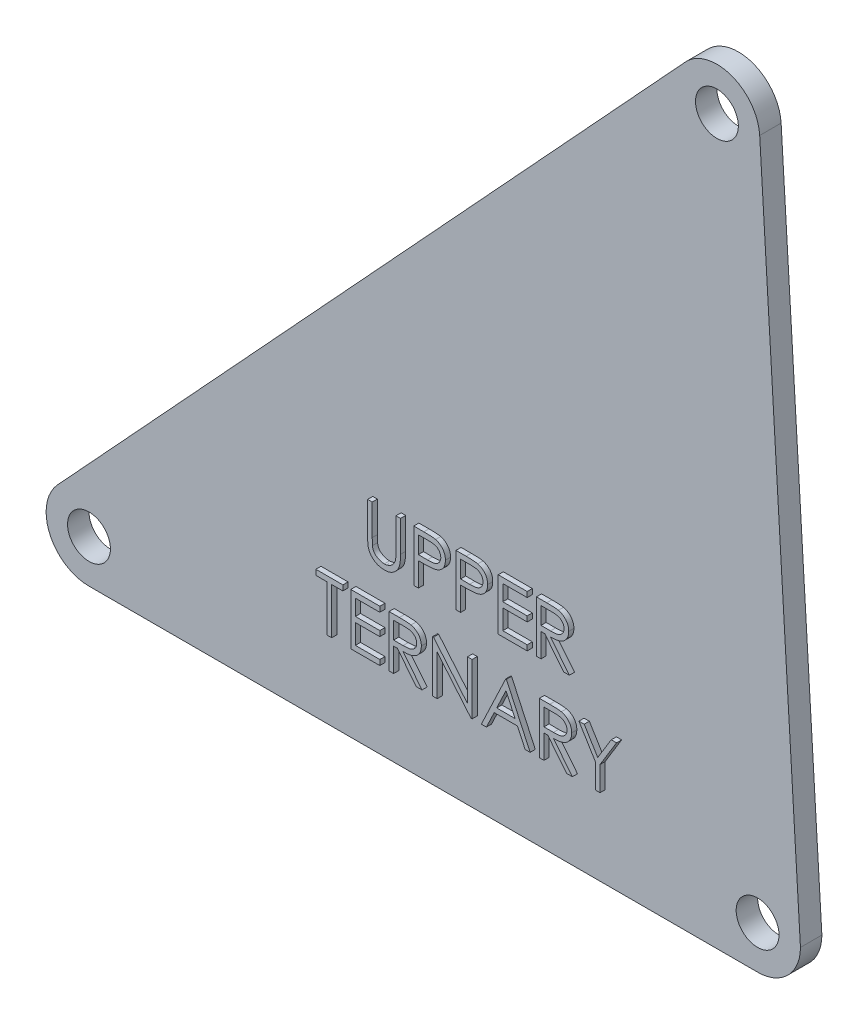
from build123d import *

# Parameters (mm, degrees)
SKETCH1_R           = 31.75
BOSS_EXTRUDE1_DEPTH = 15.875
BOSS_EXTRUDE2_DEPTH = 7.62
BOSS_EXTRUDE3_DEPTH = 7.62


with BuildPart() as part:
    # Sketch1 → Boss-Extrude1 (new, symmetric)
    with BuildSketch(Plane.XY):
        with BuildLine():
            Line((-106.923777431, 1050.920865008), (-1037.726571072, 42.559796745))
            ThreePointArc((-1037.726571072, 42.559796745), (-1048.62929042, -25.78471356), (-990.6, -63.5))
            Line((-990.6, -63.5), (0, -63.5))
            ThreePointArc((0, -63.5), (44.901280605, -44.901280605), (63.5, 0))
            Line((63.5, 0), (63.049232296, 7.552768161))
            Line((63.049232296, 7.552768161), (3.123265593, 1011.632983406))
            ThreePointArc((3.123265593, 1011.632983406), (-38.913634109, 1067.653009424), (-106.923777431, 1050.920865008))
        make_face()
        with Locations((-990.6, 0)):
            Circle(SKETCH1_R, mode=Mode.SUBTRACT)
        Circle(SKETCH1_R, mode=Mode.SUBTRACT)
        with Locations((-60.263942308, 1007.849879574)):
            Circle(SKETCH1_R, mode=Mode.SUBTRACT)
    extrude(amount=BOSS_EXTRUDE1_DEPTH, both=True)

    # Sketch4 → Boss-Extrude2 (add)
    # profile 1 of 12: a face of its own
    with BuildSketch(Plane.XY.offset(15.875)):
        with BuildLine():
            Line((-570.177815221, 261.857694941), (-563.339353683, 261.857694941))
            Line((-563.339353683, 261.857694941), (-563.339353683, 216.201805518))
            add(Edge.make_bspline(
                [(-563.339353683, 216.201805518), (-563.340371366, 215.5556135), (-563.342302595, 214.329352787), (-563.329402721, 212.583974358), (-563.2932759, 211.032271107), (-563.270499512, 209.668261768), (-563.219830136, 208.498205381), (-563.178506944, 207.515762902), (-563.125372538, 206.725586266), (-563.06151438, 206.264447248), (-563.034065221, 206.066228595)],
                knots=[0, 0, 0, 0, 1.528628734, 2.90083645, 4.128790002, 5.200304208, 6.127813768, 6.898992206, 7.526736466, 8, 8, 8, 8], degree=3))
            add(Edge.make_bspline(
                [(-563.034065221, 206.066228595), (-562.921344546, 205.351107633), (-562.702254604, 203.961160215), (-562.143896322, 201.981957051), (-561.364098157, 200.198192159), (-560.440052484, 198.554203478), (-559.222319632, 197.095749411), (-557.763556949, 195.75219857), (-555.99620096, 194.57715528), (-554.031098631, 193.502717606), (-551.913060031, 192.639152098), (-549.748734747, 191.986153709), (-547.570656172, 191.588195948), (-546.112489378, 191.542115871), (-545.388392144, 191.519233402)],
                knots=[0, 0, 0, 0, 1.035780045, 2.013197591, 2.933192213, 3.817615948, 4.702609284, 5.640816605, 6.646850145, 7.73207398, 8.84249596, 9.914020372, 10.964143139, 12, 12, 12, 12], degree=3))
            add(Edge.make_bspline(
                [(-545.388392144, 191.519233402), (-544.766736425, 191.542612657), (-543.527015506, 191.589236134), (-541.685012643, 191.877956432), (-539.891044563, 192.398305891), (-538.136252618, 193.069731489), (-536.491399757, 193.956864758), (-534.955568248, 194.981664177), (-533.584753452, 196.183683821), (-532.333810756, 197.513925607), (-531.244478724, 199.014843538), (-530.300227013, 200.653756143), (-529.526776773, 202.455327638), (-529.144829175, 203.721432488), (-528.94860849, 204.371877633)],
                knots=[0, 0, 0, 0, 0.994687771, 1.983630487, 2.973142513, 3.978332533, 4.983357753, 5.956394766, 6.925816176, 7.893390482, 8.871859704, 9.88551698, 10.913711441, 12, 12, 12, 12], degree=3))
            add(Edge.make_bspline(
                [(-528.94860849, 204.371877633), (-528.883291477, 204.640723737), (-528.737738848, 205.239821202), (-528.601731754, 206.252656156), (-528.460075401, 207.447676023), (-528.361786763, 208.833466919), (-528.265965907, 210.405385237), (-528.20864015, 212.171619757), (-528.182143605, 214.125757018), (-528.174247536, 215.489457512), (-528.170122913, 216.201805518)],
                knots=[0, 0, 0, 0, 0.558680831, 1.244966039, 2.062412453, 2.990489873, 4.051219941, 5.244515665, 6.560634259, 8, 8, 8, 8], degree=3))
            Line((-528.170122913, 216.201805518), (-528.170122913, 261.857694941))
            Line((-528.170122913, 261.857694941), (-521.331661375, 261.857694941))
            Line((-521.331661375, 261.857694941), (-521.331661375, 215.835459364))
            add(Edge.make_bspline(
                [(-521.331661375, 215.835459364), (-521.337193939, 215.006003228), (-521.347991073, 213.387269148), (-521.441620767, 211.015242417), (-521.59090745, 208.765100367), (-521.801830965, 206.636540528), (-522.081310863, 204.63717969), (-522.392102806, 202.749493022), (-522.787897212, 200.987030725), (-523.250178689, 199.336050661), (-523.778648506, 197.764468912), (-524.463167221, 196.272938501), (-525.234409191, 194.816116429), (-526.149128206, 193.41603703), (-527.176987451, 192.066501216), (-528.340706901, 190.775693355), (-529.601798632, 189.522986119), (-530.981226758, 188.340513078), (-532.45625248, 187.256107027), (-534.022488129, 186.302566983), (-535.667902373, 185.496509939), (-537.388218091, 184.833005528), (-539.184169422, 184.334121968), (-541.055801654, 183.962371434), (-543.007374948, 183.751138556), (-544.334662606, 183.719745679), (-545.006781567, 183.703848787)],
                knots=[0, 0, 0, 0, 1.316592851, 2.569410997, 3.76748051, 4.895814652, 5.963796859, 6.97159953, 7.931736103, 8.829262218, 9.692595152, 10.560224239, 11.431080259, 12.30701507, 13.211635791, 14.121146779, 15.063487852, 16.031507147, 17.00238618, 17.966455255, 18.938106653, 19.907068911, 20.888905087, 21.893141452, 22.933117798, 24, 24, 24, 24], degree=3))
            add(Edge.make_bspline(
                [(-545.006781567, 183.703848787), (-545.73980603, 183.720934248), (-547.177997403, 183.754455861), (-549.297186182, 183.946539735), (-551.328769541, 184.30834592), (-553.29420435, 184.769028123), (-555.166732202, 185.404399775), (-556.971440905, 186.146764665), (-558.677421334, 187.058492446), (-560.312349563, 188.072897174), (-561.832534254, 189.214256439), (-563.228026287, 190.458279655), (-564.501129527, 191.785038728), (-565.630385145, 193.20889812), (-566.634502689, 194.718783856), (-567.499486192, 196.318967305), (-568.24218025, 198.008828931), (-568.625500367, 199.18346718), (-568.819281567, 199.777286287)],
                knots=[0, 0, 0, 0, 1.13879206, 2.234305948, 3.301075583, 4.341971843, 5.366689343, 6.369221514, 7.369726634, 8.367512178, 9.355451585, 10.318319045, 11.268648973, 12.207971039, 13.137398894, 14.081662264, 15.030215811, 16, 16, 16, 16], degree=3))
            add(Edge.make_bspline(
                [(-568.819281567, 199.777286287), (-568.931995697, 200.182944051), (-569.176475153, 201.062824774), (-569.438283062, 202.519039182), (-569.658372211, 204.195763961), (-569.865321793, 206.093113881), (-569.98743682, 208.212559548), (-570.094496486, 210.553182231), (-570.178569444, 213.117812139), (-570.178073656, 214.904256165), (-570.177815221, 215.835459364)],
                knots=[0, 0, 0, 0, 0.625038921, 1.35572334, 2.194682327, 3.136881307, 4.189498639, 5.346923369, 6.617055217, 8, 8, 8, 8], degree=3))
            Line((-570.177815221, 215.835459364), (-570.177815221, 261.857694941))
        make_face()
    # profile 2 of 12: a face of its own
    with BuildSketch(Plane.XY.offset(15.875)):
        with BuildLine():
            Line((-501.793199836, 261.857694941), (-486.849329644, 261.857694941))
            add(Edge.make_bspline(
                [(-486.849329644, 261.857694941), (-485.821480773, 261.856565086), (-483.85207669, 261.854400233), (-481.02799462, 261.788764909), (-478.463108462, 261.70109807), (-476.162948741, 261.579572281), (-474.120438262, 261.435955088), (-472.344819341, 261.234524973), (-470.822135286, 261.024206539), (-469.909772015, 260.810380488), (-469.493680606, 260.71286321)],
                knots=[0, 0, 0, 0, 1.415646017, 2.712440637, 3.8905458, 4.950247383, 5.884950622, 6.709939814, 7.411656543, 8, 8, 8, 8], degree=3))
            add(Edge.make_bspline(
                [(-469.493680606, 260.71286321), (-468.966952813, 260.568693902), (-467.925908909, 260.283752456), (-466.425834771, 259.713042248), (-464.998633906, 259.036339109), (-463.639409691, 258.265109333), (-462.364864911, 257.366263621), (-461.155983676, 256.376238001), (-460.023434391, 255.272174708), (-458.973585802, 254.066456886), (-458.009442494, 252.779325459), (-457.179304831, 251.391566054), (-456.484203488, 249.926538248), (-455.888030549, 248.38526107), (-455.45894934, 246.754791742), (-455.135711123, 245.046459318), (-454.930545288, 243.26044692), (-454.910895229, 242.039943518), (-454.900892144, 241.418632441)],
                knots=[0, 0, 0, 0, 0.999701418, 1.975846123, 2.934577507, 3.890451536, 4.834027766, 5.787354733, 6.749476667, 7.726910423, 8.712836071, 9.690891519, 10.682875813, 11.679750201, 12.712814741, 13.765529915, 14.8625177, 16, 16, 16, 16], degree=3))
            add(Edge.make_bspline(
                [(-454.900892144, 241.418632441), (-454.910067163, 240.792099129), (-454.928018706, 239.566244388), (-455.143474975, 237.772871114), (-455.433692289, 236.059059306), (-455.8799424, 234.428608984), (-456.464411054, 232.891202782), (-457.150038034, 231.423346244), (-457.976993752, 230.050011673), (-458.927204044, 228.766213286), (-459.984241614, 227.570746052), (-461.143634153, 226.472273098), (-462.400701035, 225.477224358), (-463.751447231, 224.583369104), (-465.209041082, 223.811435248), (-466.751375969, 223.120033352), (-468.391857823, 222.53936626), (-469.527074842, 222.23391178), (-470.104257529, 222.078608402)],
                knots=[0, 0, 0, 0, 1.121902311, 2.195077645, 3.232258892, 4.234102512, 5.217864754, 6.176164875, 7.132989551, 8.084763148, 9.034132444, 9.988522005, 10.94243251, 11.903244335, 12.886203696, 13.894208494, 14.929344452, 16, 16, 16, 16], degree=3))
            add(Edge.make_bspline(
                [(-470.104257529, 222.078608402), (-470.581646914, 221.977088643), (-471.62787351, 221.754602187), (-473.350923633, 221.506223784), (-475.357060321, 221.294222306), (-477.643545387, 221.135266111), (-480.208326459, 220.99918666), (-483.052790976, 220.891024159), (-486.182522599, 220.831591341), (-488.365570828, 220.828526081), (-489.50533926, 220.82692571)],
                knots=[0, 0, 0, 0, 0.601384939, 1.31797006, 2.144135048, 3.087295005, 4.142315834, 5.309527816, 6.595305764, 8, 8, 8, 8], degree=3))
            Line((-489.50533926, 220.82692571), (-494.954738298, 220.82692571))
            Line((-494.954738298, 220.82692571), (-494.954738298, 185.657694941))
            Line((-494.954738298, 185.657694941), (-501.793199836, 185.657694941))
            Line((-501.793199836, 185.657694941), (-501.793199836, 261.857694941))
        make_face()
        with BuildLine():
            Line((-494.954738298, 254.042310325), (-494.954738298, 228.642310325))
            Line((-494.954738298, 228.642310325), (-481.613632529, 228.474401672))
            add(Edge.make_bspline(
                [(-481.613632529, 228.474401672), (-480.962233001, 228.474065007), (-479.704719643, 228.473415083), (-477.888193868, 228.560179092), (-476.202883099, 228.66033926), (-474.653964058, 228.806989936), (-473.240738513, 229.014281314), (-471.960850027, 229.223542579), (-470.824222897, 229.526282188), (-469.49400599, 229.93391015), (-468.011734253, 230.629128811), (-466.399177911, 231.638232132), (-465.032572574, 232.92450355), (-463.849985656, 234.370732335), (-462.911509113, 235.979621953), (-462.22449008, 237.701065661), (-461.820822597, 239.517409128), (-461.76669461, 240.760299465), (-461.739353683, 241.388103595)],
                knots=[0, 0, 0, 0, 1.160613943, 2.240541288, 3.23993089, 4.169200891, 5.011653406, 5.7853311, 6.478053781, 7.106038997, 8.262395093, 9.384106736, 10.481365981, 11.59014053, 12.70357646, 13.786202915, 14.881775077, 16, 16, 16, 16], degree=3))
            add(Edge.make_bspline(
                [(-461.739353683, 241.388103595), (-461.766843301, 242.00071923), (-461.821489259, 243.218523293), (-462.227654051, 245.003318024), (-462.910173399, 246.706621074), (-463.856285542, 248.295349389), (-465.004535286, 249.736374207), (-466.339109556, 250.988168802), (-467.856866845, 251.994481302), (-469.268705475, 252.643994462), (-470.522765583, 253.04056703), (-471.612032823, 253.318040414), (-472.841915508, 253.539577898), (-474.212814022, 253.718963645), (-475.714102805, 253.872527572), (-477.358679832, 253.976725134), (-479.140315151, 254.037716838), (-480.377162437, 254.040742092), (-481.018320029, 254.042310325)],
                knots=[0, 0, 0, 0, 1.120700087, 2.227813068, 3.331159281, 4.466773991, 5.599788987, 6.693661531, 7.80175334, 8.91857717, 9.525282508, 10.207424825, 10.974604443, 11.810962634, 12.737642355, 13.736264703, 14.826523623, 16, 16, 16, 16], degree=3))
            Line((-481.018320029, 254.042310325), (-494.954738298, 254.042310325))
        make_face(mode=Mode.SUBTRACT)
    # profile 3 of 12: a face of its own
    with BuildSketch(Plane.XY.offset(15.875)):
        with BuildLine():
            Line((-439.270122913, 261.857694941), (-424.326252721, 261.857694941))
            add(Edge.make_bspline(
                [(-424.326252721, 261.857694941), (-423.29840385, 261.856565086), (-421.328999766, 261.854400233), (-418.504917696, 261.788764909), (-415.940031539, 261.70109807), (-413.639871817, 261.579572281), (-411.597361339, 261.435955088), (-409.821742418, 261.234524973), (-408.299058363, 261.024206539), (-407.386695092, 260.810380488), (-406.970603683, 260.71286321)],
                knots=[0, 0, 0, 0, 1.415646017, 2.712440637, 3.8905458, 4.950247383, 5.884950622, 6.709939814, 7.411656543, 8, 8, 8, 8], degree=3))
            add(Edge.make_bspline(
                [(-406.970603683, 260.71286321), (-406.44387589, 260.568693902), (-405.402831986, 260.283752456), (-403.902757848, 259.713042248), (-402.475556983, 259.036339109), (-401.116332768, 258.265109333), (-399.841787988, 257.366263621), (-398.632906753, 256.376238001), (-397.500357468, 255.272174708), (-396.450508879, 254.066456886), (-395.486365571, 252.779325459), (-394.656227907, 251.391566054), (-393.961126565, 249.926538248), (-393.364953625, 248.38526107), (-392.935872417, 246.754791742), (-392.6126342, 245.046459318), (-392.407468365, 243.26044692), (-392.387818306, 242.039943518), (-392.377815221, 241.418632441)],
                knots=[0, 0, 0, 0, 0.999701418, 1.975846123, 2.934577507, 3.890451536, 4.834027766, 5.787354733, 6.749476667, 7.726910423, 8.712836071, 9.690891519, 10.682875813, 11.679750201, 12.712814741, 13.765529915, 14.8625177, 16, 16, 16, 16], degree=3))
            add(Edge.make_bspline(
                [(-392.377815221, 241.418632441), (-392.386990239, 240.792099129), (-392.404941783, 239.566244388), (-392.620398052, 237.772871114), (-392.910615366, 236.059059306), (-393.356865477, 234.428608984), (-393.941334131, 232.891202782), (-394.62696111, 231.423346244), (-395.453916829, 230.050011673), (-396.404127121, 228.766213286), (-397.461164691, 227.570746052), (-398.62055723, 226.472273098), (-399.877624112, 225.477224358), (-401.228370308, 224.583369104), (-402.685964159, 223.811435248), (-404.228299046, 223.120033352), (-405.8687809, 222.53936626), (-407.003997919, 222.23391178), (-407.581180606, 222.078608402)],
                knots=[0, 0, 0, 0, 1.121902311, 2.195077645, 3.232258892, 4.234102512, 5.217864754, 6.176164875, 7.132989551, 8.084763148, 9.034132444, 9.988522005, 10.94243251, 11.903244335, 12.886203696, 13.894208494, 14.929344452, 16, 16, 16, 16], degree=3))
            add(Edge.make_bspline(
                [(-407.581180606, 222.078608402), (-408.058569991, 221.977088643), (-409.104796587, 221.754602187), (-410.82784671, 221.506223784), (-412.833983398, 221.294222306), (-415.120468463, 221.135266111), (-417.685249536, 220.99918666), (-420.529714053, 220.891024159), (-423.659445676, 220.831591341), (-425.842493904, 220.828526081), (-426.982262336, 220.82692571)],
                knots=[0, 0, 0, 0, 0.601384939, 1.31797006, 2.144135048, 3.087295005, 4.142315834, 5.309527816, 6.595305764, 8, 8, 8, 8], degree=3))
            Line((-426.982262336, 220.82692571), (-432.431661375, 220.82692571))
            Line((-432.431661375, 220.82692571), (-432.431661375, 185.657694941))
            Line((-432.431661375, 185.657694941), (-439.270122913, 185.657694941))
            Line((-439.270122913, 185.657694941), (-439.270122913, 261.857694941))
        make_face()
        with BuildLine():
            Line((-432.431661375, 254.042310325), (-432.431661375, 228.642310325))
            Line((-432.431661375, 228.642310325), (-419.090555606, 228.474401672))
            add(Edge.make_bspline(
                [(-419.090555606, 228.474401672), (-418.439156078, 228.474065007), (-417.181642719, 228.473415083), (-415.365116945, 228.560179092), (-413.679806176, 228.66033926), (-412.130887135, 228.806989936), (-410.71766159, 229.014281314), (-409.437773104, 229.223542579), (-408.301145973, 229.526282188), (-406.970929066, 229.93391015), (-405.48865733, 230.629128811), (-403.876100988, 231.638232132), (-402.509495651, 232.92450355), (-401.326908733, 234.370732335), (-400.38843219, 235.979621953), (-399.701413157, 237.701065661), (-399.297745674, 239.517409128), (-399.243617687, 240.760299465), (-399.21627676, 241.388103595)],
                knots=[0, 0, 0, 0, 1.160613943, 2.240541288, 3.23993089, 4.169200891, 5.011653406, 5.7853311, 6.478053781, 7.106038997, 8.262395093, 9.384106736, 10.481365981, 11.59014053, 12.70357646, 13.786202915, 14.881775077, 16, 16, 16, 16], degree=3))
            add(Edge.make_bspline(
                [(-399.21627676, 241.388103595), (-399.243766377, 242.00071923), (-399.298412336, 243.218523293), (-399.704577128, 245.003318024), (-400.387096476, 246.706621074), (-401.333208619, 248.295349389), (-402.481458363, 249.736374207), (-403.816032633, 250.988168802), (-405.333789922, 251.994481302), (-406.745628552, 252.643994462), (-407.999688659, 253.04056703), (-409.0889559, 253.318040414), (-410.318838585, 253.539577898), (-411.689737099, 253.718963645), (-413.191025882, 253.872527572), (-414.835602909, 253.976725134), (-416.617238228, 254.037716838), (-417.854085514, 254.040742092), (-418.495243106, 254.042310325)],
                knots=[0, 0, 0, 0, 1.120700087, 2.227813068, 3.331159281, 4.466773991, 5.599788987, 6.693661531, 7.80175334, 8.91857717, 9.525282508, 10.207424825, 10.974604443, 11.810962634, 12.737642355, 13.736264703, 14.826523623, 16, 16, 16, 16], degree=3))
            Line((-418.495243106, 254.042310325), (-432.431661375, 254.042310325))
        make_face(mode=Mode.SUBTRACT)
    # profile 4 of 12: a face of its own
    with BuildSketch(Plane.XY.offset(15.875)):
        Polygon((-376.74704599, 261.857694941), (-333.762430606, 261.857694941), (-333.762430606, 254.042310325), (-369.908584452, 254.042310325), (-369.908584452, 230.596156479), (-333.762430606, 230.596156479), (-333.762430606, 222.780771864), (-369.908584452, 222.780771864), (-369.908584452, 193.473079556), (-333.762430606, 193.473079556), (-333.762430606, 185.657694941), (-376.74704599, 185.657694941), align=None)
    # profile 5 of 12: a face of its own
    with BuildSketch(Plane.XY.offset(15.875)):
        with BuildLine():
            Line((-320.085507529, 261.857694941), (-304.836348875, 261.857694941))
            add(Edge.make_bspline(
                [(-304.836348875, 261.857694941), (-303.818727734, 261.854307612), (-301.864782419, 261.847803564), (-299.065558647, 261.811537526), (-296.522065849, 261.707592982), (-294.235633919, 261.61814325), (-292.206304802, 261.455032985), (-290.427855786, 261.299135467), (-288.908477915, 261.095057481), (-287.988725381, 260.905527987), (-287.572286375, 260.819714172)],
                knots=[0, 0, 0, 0, 1.410062039, 2.707475311, 3.878576406, 4.937260626, 5.877586885, 6.699081471, 7.410979367, 8, 8, 8, 8], degree=3))
            add(Edge.make_bspline(
                [(-287.572286375, 260.819714172), (-287.014793587, 260.681971451), (-285.911700844, 260.409424437), (-284.323473692, 259.833361128), (-282.810047554, 259.166728157), (-281.377709093, 258.383746589), (-280.033632725, 257.478604243), (-278.763959787, 256.466926835), (-277.562928841, 255.354249955), (-276.479111635, 254.112519977), (-275.457181424, 252.80979368), (-274.59528047, 251.40110046), (-273.852298254, 249.928012347), (-273.260757284, 248.375547994), (-272.784442548, 246.758763133), (-272.448591279, 245.063012758), (-272.247179708, 243.296022386), (-272.226674167, 242.090801629), (-272.21627676, 241.479690133)],
                knots=[0, 0, 0, 0, 1.027469482, 2.033020251, 3.019912614, 3.986113645, 4.951240523, 5.91722682, 6.890402269, 7.87763091, 8.8651537, 9.85103654, 10.82876324, 11.815024772, 12.821070561, 13.842952187, 14.906261191, 16, 16, 16, 16], degree=3))
            add(Edge.make_bspline(
                [(-272.21627676, 241.479690133), (-272.248258947, 240.464377284), (-272.310664478, 238.483238943), (-272.892508164, 235.608084897), (-273.845585536, 232.926077532), (-275.158909714, 230.440593815), (-276.831379443, 228.200082051), (-278.841422037, 226.232152709), (-281.190158836, 224.585363755), (-283.376648515, 223.443391264), (-285.308083377, 222.712025654), (-286.898122929, 222.197428355), (-288.632586839, 221.799839282), (-290.49485681, 221.443655842), (-292.492682681, 221.17474181), (-294.62127611, 220.977784524), (-296.882155183, 220.854687807), (-298.435308635, 220.836356158), (-299.234305606, 220.82692571)],
                knots=[0, 0, 0, 0, 1.260483769, 2.459530307, 3.627416485, 4.787058657, 5.939039949, 7.08810263, 8.267026773, 9.491475466, 10.141966685, 10.831826277, 11.566392101, 12.351337768, 13.187381173, 14.07005841, 15.007169909, 16, 16, 16, 16], degree=3))
            Line((-299.234305606, 220.82692571), (-271.239353683, 185.657694941))
            Line((-271.239353683, 185.657694941), (-279.695844067, 185.657694941))
            Line((-279.695844067, 185.657694941), (-307.69079599, 220.82692571))
            Line((-307.69079599, 220.82692571), (-313.24704599, 220.82692571))
            Line((-313.24704599, 220.82692571), (-313.24704599, 185.657694941))
            Line((-313.24704599, 185.657694941), (-320.085507529, 185.657694941))
            Line((-320.085507529, 185.657694941), (-320.085507529, 261.857694941))
        make_face()
        with BuildLine():
            Line((-313.24704599, 254.042310325), (-313.24704599, 228.642310325))
            Line((-313.24704599, 228.642310325), (-299.295363298, 228.535459364))
            add(Edge.make_bspline(
                [(-299.295363298, 228.535459364), (-298.643961308, 228.535171183), (-297.381358721, 228.534612606), (-295.55472139, 228.621562821), (-293.853934959, 228.720477349), (-292.285504869, 228.871774529), (-290.848730457, 229.066761005), (-289.544329861, 229.310665976), (-288.370173817, 229.594828026), (-287.00078278, 230.034646279), (-285.471633155, 230.73146302), (-283.809788228, 231.745260448), (-282.394594475, 233.020393843), (-281.198954158, 234.478501657), (-280.238193393, 236.081667989), (-279.560839524, 237.810675799), (-279.131018352, 239.621875732), (-279.080322591, 240.866724823), (-279.054738298, 241.494954556)],
                knots=[0, 0, 0, 0, 1.146690395, 2.22261258, 3.21895312, 4.145990853, 4.996080663, 5.770904154, 6.481378293, 7.121626537, 8.300444488, 9.431385265, 10.535395872, 11.636531494, 12.74115979, 13.810798291, 14.895190096, 16, 16, 16, 16], degree=3))
            add(Edge.make_bspline(
                [(-279.054738298, 241.494954556), (-279.080910191, 242.107745676), (-279.132773334, 243.322074072), (-279.556200809, 245.09983989), (-280.272249626, 246.77769749), (-281.237208063, 248.348821421), (-282.412846808, 249.77497487), (-283.791366045, 250.995201459), (-285.335073436, 252.002118376), (-286.777892097, 252.64555946), (-288.067505524, 253.040054551), (-289.187202694, 253.317665603), (-290.45237258, 253.540702327), (-291.869158279, 253.719403538), (-293.431511498, 253.872999752), (-295.147331959, 253.976452762), (-297.005235575, 254.037714604), (-298.292948762, 254.040742767), (-298.95954599, 254.042310325)],
                knots=[0, 0, 0, 0, 1.101028733, 2.181837193, 3.264309656, 4.369019818, 5.486613113, 6.575447106, 7.666700264, 8.788928104, 9.402425223, 10.0903467, 10.862060571, 11.710948788, 12.657782767, 13.684531032, 14.801375019, 16, 16, 16, 16], degree=3))
            Line((-298.95954599, 254.042310325), (-313.24704599, 254.042310325))
        make_face(mode=Mode.SUBTRACT)
    # profile 6 of 12: a face of its own
    with BuildSketch(Plane.XY.offset(15.875)):
        Polygon((-646.86627676, 126.042310325), (-646.86627676, 133.857694941), (-606.812430606, 133.857694941), (-606.812430606, 126.042310325), (-623.420122913, 126.042310325), (-623.420122913, 57.657694941), (-630.258584452, 57.657694941), (-630.258584452, 126.042310325), align=None)
    # profile 7 of 12: a face of its own
    with BuildSketch(Plane.XY.offset(15.875)):
        Polygon((-595.089353683, 133.857694941), (-552.104738298, 133.857694941), (-552.104738298, 126.042310325), (-588.250892144, 126.042310325), (-588.250892144, 102.596156479), (-552.104738298, 102.596156479), (-552.104738298, 94.780771864), (-588.250892144, 94.780771864), (-588.250892144, 65.473079556), (-552.104738298, 65.473079556), (-552.104738298, 57.657694941), (-595.089353683, 57.657694941), align=None)
    # profile 8 of 12: a face of its own
    with BuildSketch(Plane.XY.offset(15.875)):
        with BuildLine():
            Line((-538.427815221, 133.857694941), (-523.178656567, 133.857694941))
            add(Edge.make_bspline(
                [(-523.178656567, 133.857694941), (-522.161035426, 133.854307612), (-520.207090111, 133.847803564), (-517.407866339, 133.811537526), (-514.864373542, 133.707592982), (-512.577941611, 133.61814325), (-510.548612494, 133.455032985), (-508.770163479, 133.299135467), (-507.250785607, 133.095057481), (-506.331033073, 132.905527987), (-505.914594067, 132.819714172)],
                knots=[0, 0, 0, 0, 1.410062039, 2.707475311, 3.878576406, 4.937260626, 5.877586885, 6.699081471, 7.410979367, 8, 8, 8, 8], degree=3))
            add(Edge.make_bspline(
                [(-505.914594067, 132.819714172), (-505.357101279, 132.681971451), (-504.254008537, 132.409424437), (-502.665781385, 131.833361128), (-501.152355246, 131.166728157), (-499.720016785, 130.383746589), (-498.375940417, 129.478604243), (-497.106267479, 128.466926835), (-495.905236533, 127.354249955), (-494.821419328, 126.112519977), (-493.799489117, 124.80979368), (-492.937588162, 123.40110046), (-492.194605947, 121.928012347), (-491.603064977, 120.375547994), (-491.12675024, 118.758763133), (-490.790898971, 117.063012758), (-490.589487401, 115.296022386), (-490.56898186, 114.090801629), (-490.558584452, 113.479690133)],
                knots=[0, 0, 0, 0, 1.027469482, 2.033020251, 3.019912614, 3.986113645, 4.951240523, 5.91722682, 6.890402269, 7.87763091, 8.8651537, 9.85103654, 10.82876324, 11.815024772, 12.821070561, 13.842952187, 14.906261191, 16, 16, 16, 16], degree=3))
            add(Edge.make_bspline(
                [(-490.558584452, 113.479690133), (-490.590566639, 112.464377284), (-490.65297217, 110.483238943), (-491.234815856, 107.608084897), (-492.187893229, 104.926077532), (-493.501217406, 102.440593815), (-495.173687135, 100.200082051), (-497.18372973, 98.232152709), (-499.532466528, 96.585363755), (-501.718956207, 95.443391264), (-503.650391069, 94.712025654), (-505.240430622, 94.197428355), (-506.974894532, 93.799839282), (-508.837164502, 93.443655842), (-510.834990373, 93.17474181), (-512.963583802, 92.977784524), (-515.224462875, 92.854687807), (-516.777616328, 92.836356158), (-517.576613298, 92.82692571)],
                knots=[0, 0, 0, 0, 1.260483769, 2.459530307, 3.627416485, 4.787058657, 5.939039949, 7.08810263, 8.267026773, 9.491475466, 10.141966685, 10.831826277, 11.566392101, 12.351337768, 13.187381173, 14.07005841, 15.007169909, 16, 16, 16, 16], degree=3))
            Line((-517.576613298, 92.82692571), (-489.581661375, 57.657694941))
            Line((-489.581661375, 57.657694941), (-498.03815176, 57.657694941))
            Line((-498.03815176, 57.657694941), (-526.033103683, 92.82692571))
            Line((-526.033103683, 92.82692571), (-531.589353683, 92.82692571))
            Line((-531.589353683, 92.82692571), (-531.589353683, 57.657694941))
            Line((-531.589353683, 57.657694941), (-538.427815221, 57.657694941))
            Line((-538.427815221, 57.657694941), (-538.427815221, 133.857694941))
        make_face()
        with BuildLine():
            Line((-531.589353683, 126.042310325), (-531.589353683, 100.642310325))
            Line((-531.589353683, 100.642310325), (-517.63767099, 100.535459364))
            add(Edge.make_bspline(
                [(-517.63767099, 100.535459364), (-516.986269, 100.535171183), (-515.723666414, 100.534612606), (-513.897029083, 100.621562821), (-512.196242651, 100.720477349), (-510.627812561, 100.871774529), (-509.19103815, 101.066761005), (-507.886637553, 101.310665976), (-506.712481509, 101.594828026), (-505.343090472, 102.034646279), (-503.813940847, 102.73146302), (-502.15209592, 103.745260448), (-500.736902167, 105.020393843), (-499.541261851, 106.478501657), (-498.580501085, 108.081667989), (-497.903147217, 109.810675799), (-497.473326045, 111.621875732), (-497.422630284, 112.866724823), (-497.39704599, 113.494954556)],
                knots=[0, 0, 0, 0, 1.146690395, 2.22261258, 3.21895312, 4.145990853, 4.996080663, 5.770904154, 6.481378293, 7.121626537, 8.300444488, 9.431385265, 10.535395872, 11.636531494, 12.74115979, 13.810798291, 14.895190096, 16, 16, 16, 16], degree=3))
            add(Edge.make_bspline(
                [(-497.39704599, 113.494954556), (-497.423217884, 114.107745676), (-497.475081027, 115.322074072), (-497.898508501, 117.09983989), (-498.614557318, 118.77769749), (-499.579515755, 120.348821421), (-500.755154501, 121.77497487), (-502.133673737, 122.995201459), (-503.677381128, 124.002118376), (-505.12019979, 124.64555946), (-506.409813216, 125.040054551), (-507.529510386, 125.317665603), (-508.794680272, 125.540702327), (-510.211465971, 125.719403538), (-511.77381919, 125.872999752), (-513.489639651, 125.976452762), (-515.347543267, 126.037714604), (-516.635256455, 126.040742767), (-517.301853683, 126.042310325)],
                knots=[0, 0, 0, 0, 1.101028733, 2.181837193, 3.264309656, 4.369019818, 5.486613113, 6.575447106, 7.666700264, 8.788928104, 9.402425223, 10.0903467, 10.862060571, 11.710948788, 12.657782767, 13.684531032, 14.801375019, 16, 16, 16, 16], degree=3))
            Line((-517.301853683, 126.042310325), (-531.589353683, 126.042310325))
        make_face(mode=Mode.SUBTRACT)
    # profile 9 of 12: a face of its own
    with BuildSketch(Plane.XY.offset(15.875)):
        Polygon((-473.950892144, 57.657694941), (-473.950892144, 133.857694941), (-472.516036375, 133.857694941), (-422.173969067, 73.883776672), (-422.173969067, 133.857694941), (-415.335507529, 133.857694941), (-415.335507529, 57.657694941), (-416.892478683, 57.657694941), (-467.112430606, 117.494233402), (-467.112430606, 57.657694941), align=None)
    # profile 10 of 12: a face of its own
    with BuildSketch(Plane.XY.offset(15.875)):
        Polygon((-364.535507529, 133.857694941), (-329.36627676, 57.657694941), (-336.800050798, 57.657694941), (-348.065195029, 82.080771864), (-382.608584452, 82.080771864), (-394.194281567, 57.657694941), (-401.658584452, 57.657694941), (-365.512430606, 133.857694941), align=None)
        Polygon((-365.100291183, 119.005411287), (-378.899329644, 89.896156479), (-351.667598875, 89.896156479), align=None, mode=Mode.SUBTRACT)
    # profile 11 of 12: a face of its own
    with BuildSketch(Plane.XY.offset(15.875)):
        with BuildLine():
            Line((-315.689353683, 133.857694941), (-300.440195029, 133.857694941))
            add(Edge.make_bspline(
                [(-300.440195029, 133.857694941), (-299.422573888, 133.854307612), (-297.468628573, 133.847803564), (-294.669404801, 133.811537526), (-292.125912003, 133.707592982), (-289.839480073, 133.61814325), (-287.810150956, 133.455032985), (-286.03170194, 133.299135467), (-284.512324069, 133.095057481), (-283.592571535, 132.905527987), (-283.176132529, 132.819714172)],
                knots=[0, 0, 0, 0, 1.410062039, 2.707475311, 3.878576406, 4.937260626, 5.877586885, 6.699081471, 7.410979367, 8, 8, 8, 8], degree=3))
            add(Edge.make_bspline(
                [(-283.176132529, 132.819714172), (-282.61863974, 132.681971451), (-281.515546998, 132.409424437), (-279.927319846, 131.833361128), (-278.413893708, 131.166728157), (-276.981555247, 130.383746589), (-275.637478878, 129.478604243), (-274.36780594, 128.466926835), (-273.166774995, 127.354249955), (-272.082957789, 126.112519977), (-271.061027578, 124.80979368), (-270.199126624, 123.40110046), (-269.456144408, 121.928012347), (-268.864603438, 120.375547994), (-268.388288701, 118.758763133), (-268.052437433, 117.063012758), (-267.851025862, 115.296022386), (-267.830520321, 114.090801629), (-267.820122913, 113.479690133)],
                knots=[0, 0, 0, 0, 1.027469482, 2.033020251, 3.019912614, 3.986113645, 4.951240523, 5.91722682, 6.890402269, 7.87763091, 8.8651537, 9.85103654, 10.82876324, 11.815024772, 12.821070561, 13.842952187, 14.906261191, 16, 16, 16, 16], degree=3))
            add(Edge.make_bspline(
                [(-267.820122913, 113.479690133), (-267.852105101, 112.464377284), (-267.914510632, 110.483238943), (-268.496354318, 107.608084897), (-269.44943169, 104.926077532), (-270.762755868, 102.440593815), (-272.435225596, 100.200082051), (-274.445268191, 98.232152709), (-276.79400499, 96.585363755), (-278.980494668, 95.443391264), (-280.91192953, 94.712025654), (-282.501969083, 94.197428355), (-284.236432993, 93.799839282), (-286.098702964, 93.443655842), (-288.096528835, 93.17474181), (-290.225122264, 92.977784524), (-292.486001336, 92.854687807), (-294.039154789, 92.836356158), (-294.83815176, 92.82692571)],
                knots=[0, 0, 0, 0, 1.260483769, 2.459530307, 3.627416485, 4.787058657, 5.939039949, 7.08810263, 8.267026773, 9.491475466, 10.141966685, 10.831826277, 11.566392101, 12.351337768, 13.187381173, 14.07005841, 15.007169909, 16, 16, 16, 16], degree=3))
            Line((-294.83815176, 92.82692571), (-266.843199836, 57.657694941))
            Line((-266.843199836, 57.657694941), (-275.299690221, 57.657694941))
            Line((-275.299690221, 57.657694941), (-303.294642144, 92.82692571))
            Line((-303.294642144, 92.82692571), (-308.850892144, 92.82692571))
            Line((-308.850892144, 92.82692571), (-308.850892144, 57.657694941))
            Line((-308.850892144, 57.657694941), (-315.689353683, 57.657694941))
            Line((-315.689353683, 57.657694941), (-315.689353683, 133.857694941))
        make_face()
        with BuildLine():
            Line((-308.850892144, 126.042310325), (-308.850892144, 100.642310325))
            Line((-308.850892144, 100.642310325), (-294.899209452, 100.535459364))
            add(Edge.make_bspline(
                [(-294.899209452, 100.535459364), (-294.247807462, 100.535171183), (-292.985204875, 100.534612606), (-291.158567544, 100.621562821), (-289.457781112, 100.720477349), (-287.889351022, 100.871774529), (-286.452576611, 101.066761005), (-285.148176015, 101.310665976), (-283.974019971, 101.594828026), (-282.604628934, 102.034646279), (-281.075479308, 102.73146302), (-279.413634382, 103.745260448), (-277.998440629, 105.020393843), (-276.802800312, 106.478501657), (-275.842039547, 108.081667989), (-275.164685678, 109.810675799), (-274.734864506, 111.621875732), (-274.684168745, 112.866724823), (-274.658584452, 113.494954556)],
                knots=[0, 0, 0, 0, 1.146690395, 2.22261258, 3.21895312, 4.145990853, 4.996080663, 5.770904154, 6.481378293, 7.121626537, 8.300444488, 9.431385265, 10.535395872, 11.636531494, 12.74115979, 13.810798291, 14.895190096, 16, 16, 16, 16], degree=3))
            add(Edge.make_bspline(
                [(-274.658584452, 113.494954556), (-274.684756345, 114.107745676), (-274.736619488, 115.322074072), (-275.160046963, 117.09983989), (-275.87609578, 118.77769749), (-276.841054217, 120.348821421), (-278.016692962, 121.77497487), (-279.395212198, 122.995201459), (-280.93891959, 124.002118376), (-282.381738251, 124.64555946), (-283.671351678, 125.040054551), (-284.791048848, 125.317665603), (-286.056218734, 125.540702327), (-287.473004433, 125.719403538), (-289.035357652, 125.872999752), (-290.751178113, 125.976452762), (-292.609081729, 126.037714604), (-293.896794916, 126.040742767), (-294.563392144, 126.042310325)],
                knots=[0, 0, 0, 0, 1.101028733, 2.181837193, 3.264309656, 4.369019818, 5.486613113, 6.575447106, 7.666700264, 8.788928104, 9.402425223, 10.0903467, 10.862060571, 11.710948788, 12.657782767, 13.684531032, 14.801375019, 16, 16, 16, 16], degree=3))
            Line((-294.563392144, 126.042310325), (-308.850892144, 126.042310325))
        make_face(mode=Mode.SUBTRACT)
    # profile 12 of 12: a face of its own
    with BuildSketch(Plane.XY.offset(15.875)):
        Polygon((-257.073969067, 133.857694941), (-249.243320029, 133.857694941), (-229.216396952, 101.115507441), (-209.220002721, 133.857694941), (-201.389353683, 133.857694941), (-225.812430606, 93.880170902), (-225.812430606, 57.657694941), (-232.650892144, 57.657694941), (-232.650892144, 93.880170902), align=None)
    extrude(amount=BOSS_EXTRUDE2_DEPTH)

    # Sketch5 → Boss-Extrude3 (add)
    # profile 1 of 12: a face of its own
    with BuildSketch(Plane(origin=(0, 0, -15.875), x_dir=(-1, 0, 0), z_dir=(0, 0, -1))):
        with BuildLine():
            Line((539.893199836, 261.857694941), (578.695363298, 261.857694941))
            add(Edge.make_bspline(
                [(578.695363298, 261.857694941), (579.611827099, 261.845206538), (581.392262977, 261.820945022), (583.983615002, 261.571235946), (586.414697773, 261.168382799), (588.684765275, 260.583375988), (590.804152257, 259.855757297), (592.766065006, 258.956398263), (594.568106212, 257.881522242), (596.195443148, 256.641335046), (597.66681409, 255.289331399), (598.937738629, 253.816667435), (600.021507494, 252.24942367), (600.892738053, 250.569217277), (601.587547688, 248.790281583), (602.070292526, 246.904133781), (602.370453699, 244.918785472), (602.400784643, 243.561839183), (602.41627676, 242.868752633)],
                knots=[0, 0, 0, 0, 1.283879857, 2.49422373, 3.644109154, 4.733564, 5.775312755, 6.780226247, 7.752329523, 8.709173768, 9.642539369, 10.547364715, 11.429401853, 12.306410462, 13.193533583, 14.099706314, 15.029388263, 16, 16, 16, 16], degree=3))
            add(Edge.make_bspline(
                [(602.41627676, 242.868752633), (602.391196396, 242.041730335), (602.34196246, 240.418246591), (601.827466936, 238.061610272), (601.036576197, 235.83635078), (599.914531387, 233.770038418), (598.494318988, 231.87432797), (596.789735927, 230.170126984), (594.790046622, 228.682010389), (592.913633676, 227.610267435), (591.218397752, 226.871915953), (589.765812519, 226.329985673), (588.126914382, 225.872699826), (586.324915969, 225.429575217), (584.355506353, 225.016879318), (582.216547795, 224.654751104), (579.905685818, 224.331962483), (578.304165434, 224.164850352), (577.474209452, 224.078247825)],
                knots=[0, 0, 0, 0, 1.137224841, 2.232425953, 3.305140778, 4.380461003, 5.456671101, 6.556546416, 7.687407718, 8.879760467, 9.522878125, 10.232239294, 11.012772474, 11.864150045, 12.787583039, 13.782812018, 14.85098657, 16, 16, 16, 16], degree=3))
            add(Edge.make_bspline(
                [(577.474209452, 224.078247825), (578.070439944, 223.913458485), (579.220546415, 223.59558597), (580.861529726, 223.087836914), (582.369617947, 222.60833397), (583.718951312, 222.100828594), (584.933849121, 221.615117779), (586.001649378, 221.132187348), (586.924768863, 220.643068088), (587.955991972, 219.999637503), (589.076275054, 219.106292389), (590.298441184, 217.9361102), (591.34841422, 216.59034518), (592.133350065, 215.350991109), (592.699853315, 214.205421511), (593.103810515, 213.132073386), (593.531565059, 211.877570727), (593.93957165, 210.413038519), (594.345867974, 208.757422229), (594.760332108, 206.900245462), (595.167851795, 204.848377589), (595.427432918, 203.410638269), (595.562550798, 202.662262249)],
                knots=[0, 0, 0, 0, 1.206438829, 2.327175689, 3.350287853, 4.292307306, 5.138200021, 5.902044599, 6.576893256, 7.174411928, 8.270266093, 9.365086199, 10.467079651, 11.590581327, 12.220829487, 12.956161795, 13.825482602, 14.805624267, 15.920059975, 17.150426224, 18.516732029, 20, 20, 20, 20], degree=3))
            add(Edge.make_bspline(
                [(595.562550798, 202.662262249), (595.658595477, 202.121703309), (595.845134537, 201.071823632), (596.210405539, 199.56549089), (596.554507143, 198.160959126), (596.988358844, 196.887643442), (597.390264973, 195.711836413), (597.881261721, 194.673593768), (598.355446765, 193.725749963), (598.736621377, 193.164235726), (598.920723875, 192.893031479)],
                knots=[0, 0, 0, 0, 1.265772579, 2.458397796, 3.57407367, 4.598249002, 5.559666784, 6.436597769, 7.244896572, 8, 8, 8, 8], degree=3))
            add(Edge.make_bspline(
                [(598.920723875, 192.893031479), (599.193891999, 192.541312134), (599.700177117, 191.88944153), (600.586137998, 191.126474836), (601.52695879, 190.639576528), (602.187425455, 190.574084848), (602.507863298, 190.542310325)],
                knots=[0, 0, 0, 0, 1.199130811, 2.222448485, 3.137587403, 4, 4, 4, 4], degree=3))
            add(Edge.make_bspline(
                [(602.507863298, 190.542310325), (602.838989719, 190.577949976), (603.51902158, 190.65114286), (604.492777633, 191.178069209), (605.391247717, 192.021410614), (606.098386184, 192.941660764), (606.623740647, 193.854581541), (606.993267105, 194.692886495), (607.308014854, 195.655313555), (607.576214109, 196.743975564), (607.823041544, 197.949794055), (608.017859721, 199.280019156), (608.166669259, 200.732001321), (608.239811938, 201.741088407), (608.277815221, 202.265387249)],
                knots=[0, 0, 0, 0, 0.841138524, 1.72743991, 2.754725145, 3.964622261, 4.666710373, 5.432135723, 6.292307162, 7.241054536, 8.285106602, 9.424516758, 10.661837121, 12, 12, 12, 12], degree=3))
            Line((608.277815221, 202.265387249), (611.208584452, 202.265387249))
            add(Edge.make_bspline(
                [(611.208584452, 202.265387249), (611.160306627, 201.557410396), (611.066291036, 200.178705748), (610.802550621, 198.187541351), (610.471236872, 196.325876301), (610.050780221, 194.604809391), (609.52807323, 193.018387692), (608.924113219, 191.571715861), (608.230488844, 190.258132232), (607.460590592, 189.076622271), (606.575246222, 188.04475877), (605.620471609, 187.138065031), (604.562082749, 186.384663967), (603.432446234, 185.746570769), (602.1929703, 185.282143062), (600.881691105, 184.923030032), (599.47584784, 184.730214821), (598.514189844, 184.697552596), (598.020122913, 184.680771864)],
                knots=[0, 0, 0, 0, 1.379193329, 2.685822633, 3.902295341, 5.05381776, 6.126696511, 7.14627144, 8.097589069, 9.011132489, 9.881232234, 10.734986358, 11.564030858, 12.400827998, 13.249467195, 14.130017788, 15.039267208, 16, 16, 16, 16], degree=3))
            add(Edge.make_bspline(
                [(598.020122913, 184.680771864), (597.402840476, 184.704401868), (596.198549294, 184.750502979), (594.451300599, 185.105717058), (592.833655031, 185.710077775), (591.335522482, 186.528729129), (590.014764253, 187.616932601), (588.856323813, 188.918229034), (587.862626709, 190.443655876), (587.383471158, 191.586671797), (587.13658926, 192.175603595)],
                knots=[0, 0, 0, 0, 1.047310067, 2.043256379, 3.010632594, 3.969450702, 4.927140125, 5.899707092, 6.917837227, 8, 8, 8, 8], degree=3))
            add(Edge.make_bspline(
                [(587.13658926, 192.175603595), (587.041649623, 192.454428209), (586.822959726, 193.096690267), (586.542356129, 194.214495744), (586.258795482, 195.611661747), (585.950599599, 197.289966217), (585.657808551, 199.251994983), (585.328831685, 201.489015097), (585.016051429, 204.009554055), (584.805329369, 205.786284699), (584.694281567, 206.722598787)],
                knots=[0, 0, 0, 0, 0.478390711, 1.10195509, 1.870434605, 2.794664839, 3.873792197, 5.093131774, 6.468118011, 8, 8, 8, 8], degree=3))
            add(Edge.make_bspline(
                [(584.694281567, 206.722598787), (584.633763178, 207.272904915), (584.517452504, 208.33054174), (584.258827554, 209.848855466), (584.012520809, 211.247134338), (583.716900567, 212.524164325), (583.407112384, 213.679043372), (583.048538479, 214.70411373), (582.694181288, 215.617266874), (582.139568656, 216.649381623), (581.327351292, 217.817578387), (580.132583394, 219.061887958), (578.678687614, 220.129737558), (577.033769885, 221.082539906), (575.169030063, 221.839291039), (573.123282615, 222.383427958), (570.906961291, 222.729726948), (569.37015159, 222.763367314), (568.575050798, 222.780771864)],
                knots=[0, 0, 0, 0, 1.028548164, 1.976773217, 2.861390999, 3.666484284, 4.412018593, 5.081814562, 5.684068578, 6.229699931, 7.255288488, 8.31854149, 9.419144819, 10.596629043, 11.843300618, 13.146114873, 14.523482561, 16, 16, 16, 16], degree=3))
            Line((568.575050798, 222.780771864), (562.362430606, 222.780771864))
            Line((562.362430606, 222.780771864), (562.362430606, 193.183055518))
            add(Edge.make_bspline(
                [(562.362430606, 193.183055518), (562.371601484, 192.891475031), (562.388713359, 192.347417107), (562.577097716, 191.604856455), (562.85512213, 190.973703299), (563.16127221, 190.672307262), (563.308824836, 190.527045902)],
                knots=[0, 0, 0, 0, 1.200674003, 2.240328943, 3.151905871, 4, 4, 4, 4], degree=3))
            add(Edge.make_bspline(
                [(563.308824836, 190.527045902), (563.531792248, 190.372762475), (563.9995583, 190.049089391), (564.88137059, 189.778785927), (565.900588945, 189.592994656), (566.640406369, 189.574963891), (567.033344067, 189.565387249)],
                knots=[0, 0, 0, 0, 0.826964289, 1.734898464, 2.796941306, 4, 4, 4, 4], degree=3))
            Line((567.033344067, 189.565387249), (574.085507529, 189.565387249))
            Line((574.085507529, 189.565387249), (574.085507529, 185.657694941))
            Line((574.085507529, 185.657694941), (539.893199836, 185.657694941))
            Line((539.893199836, 185.657694941), (539.893199836, 189.565387249))
            Line((539.893199836, 189.565387249), (547.036949836, 189.565387249))
            add(Edge.make_bspline(
                [(547.036949836, 189.565387249), (547.404243948, 189.575284501), (548.093192736, 189.593849187), (549.0517886, 189.775874578), (549.863802183, 190.070367447), (550.512416601, 190.513395727), (551.011234104, 191.058640918), (551.370899559, 191.694613075), (551.571343979, 192.42853497), (551.600771637, 192.942684444), (551.61627676, 193.213584364)],
                knots=[0, 0, 0, 0, 1.322849184, 2.481323038, 3.503366862, 4.414154492, 5.284122715, 6.146514873, 7.023418293, 8, 8, 8, 8], degree=3))
            Line((551.61627676, 193.213584364), (551.61627676, 254.042310325))
            add(Edge.make_bspline(
                [(551.61627676, 254.042310325), (551.59995845, 254.348266513), (551.569112705, 254.926601341), (551.383835095, 255.749318481), (551.001692977, 256.430115193), (550.501640237, 257.007796182), (549.837834337, 257.435656018), (549.033708433, 257.744100513), (548.082380862, 257.919468982), (547.398936542, 257.939430175), (547.036949836, 257.950002633)],
                knots=[0, 0, 0, 0, 1.066531836, 2.016015794, 2.903845426, 3.757070895, 4.651239732, 5.621644264, 6.74030242, 8, 8, 8, 8], degree=3))
            Line((547.036949836, 257.950002633), (539.893199836, 257.950002633))
            Line((539.893199836, 257.950002633), (539.893199836, 261.857694941))
        make_face()
        with BuildLine():
            Line((562.362430606, 226.688464172), (571.06315176, 226.688464172))
            add(Edge.make_bspline(
                [(571.06315176, 226.688464172), (571.775659951, 226.702533406), (573.156539163, 226.729800339), (575.17207697, 226.873138587), (577.065168396, 227.159090486), (578.85233857, 227.505318659), (580.504945326, 228.006834557), (582.050553227, 228.577623348), (583.463072214, 229.28819007), (584.785838015, 230.071499968), (585.951968069, 231.028042433), (586.983203269, 232.136039463), (587.816389483, 233.444125327), (588.526319768, 234.894845534), (589.050278752, 236.521993231), (589.453890159, 238.302956252), (589.674315283, 240.258113205), (589.701971407, 241.616563864), (589.71627676, 242.319233402)],
                knots=[0, 0, 0, 0, 1.219595185, 2.363641091, 3.454730401, 4.494761589, 5.475621669, 6.407157146, 7.310634959, 8.178322238, 9.032401173, 9.882921431, 10.757225062, 11.676345793, 12.640127146, 13.675298604, 14.79752949, 16, 16, 16, 16], degree=3))
            add(Edge.make_bspline(
                [(589.71627676, 242.319233402), (589.691660272, 243.271496261), (589.644890403, 245.080739365), (589.329977236, 247.646781627), (588.734856495, 249.892706665), (587.928915671, 251.835959558), (586.907529065, 253.46315432), (585.763874789, 254.838448026), (584.440113049, 255.912466381), (583.192787409, 256.585687594), (582.056907382, 256.987958253), (581.017583282, 257.240582318), (579.800282821, 257.468070996), (578.393443692, 257.646885448), (576.809062095, 257.775976066), (575.043419583, 257.88690377), (573.093716571, 257.945108464), (571.729730907, 257.948323505), (571.01735849, 257.950002633)],
                knots=[0, 0, 0, 0, 1.583904885, 3.009325589, 4.288147178, 5.437094785, 6.493769576, 7.47222241, 8.398684323, 9.311127006, 9.814333876, 10.39927682, 11.088061335, 11.873191318, 12.756563886, 13.731534083, 14.815242278, 16, 16, 16, 16], degree=3))
            add(Edge.make_bspline(
                [(571.01735849, 257.950002633), (570.549289418, 257.945187257), (569.663928926, 257.936078892), (568.405709256, 257.91898222), (567.292159258, 257.832112768), (566.312754541, 257.752208625), (565.474138313, 257.623673919), (564.764287262, 257.501690698), (564.20194084, 257.320468889), (563.643317906, 257.060824642), (563.110768321, 256.620313456), (562.675014304, 255.934099479), (562.406275289, 255.104403798), (562.377736969, 254.502511552), (562.362430606, 254.179690133)],
                knots=[0, 0, 0, 0, 1.568367801, 2.966593976, 4.213901723, 5.309659579, 6.257081416, 7.056086357, 7.719147992, 8.229973534, 9.113927885, 9.988629374, 10.921213019, 12, 12, 12, 12], degree=3))
            Line((562.362430606, 254.179690133), (562.362430606, 226.688464172))
        make_face(mode=Mode.SUBTRACT)
    # profile 2 of 12: a face of its own
    with BuildSketch(Plane(origin=(0, 0, -15.875), x_dir=(-1, 0, 0), z_dir=(0, 0, -1))):
        with BuildLine():
            Line((465.64704599, 261.857694941), (528.170122913, 261.857694941))
            Line((528.170122913, 261.857694941), (529.14704599, 236.457694941))
            Line((529.14704599, 236.457694941), (525.239353683, 236.457694941))
            add(Edge.make_bspline(
                [(525.239353683, 236.457694941), (525.066900678, 237.421614031), (524.734006287, 239.282313764), (524.079505474, 241.93574453), (523.396131823, 244.375353833), (522.590194017, 246.575092609), (521.753667999, 248.573293185), (520.800362557, 250.328140076), (519.801400092, 251.878743805), (518.685529024, 253.189434905), (517.49286642, 254.311974151), (516.24601752, 255.299670966), (514.894344802, 256.116579288), (513.462121867, 256.788957765), (511.93927047, 257.3035368), (510.34308303, 257.696145159), (508.652384706, 257.903068635), (507.497502516, 257.93411993), (506.906781567, 257.950002633)],
                knots=[0, 0, 0, 0, 1.503224747, 2.90174758, 4.194974726, 5.39117008, 6.497103084, 7.517871789, 8.454010128, 9.324355652, 10.153354504, 10.966067001, 11.762006653, 12.572914456, 13.390755945, 14.22646537, 15.092839019, 16, 16, 16, 16], degree=3))
            Line((506.906781567, 257.950002633), (491.810267144, 257.950002633))
            add(Edge.make_bspline(
                [(491.810267144, 257.950002633), (491.524608732, 257.938955597), (490.982266905, 257.91798205), (490.216731409, 257.743829567), (489.576305791, 257.405409382), (489.024525909, 256.979849635), (488.598823324, 256.405510033), (488.313487475, 255.702464147), (488.14881732, 254.874099563), (488.127610019, 254.282266146), (488.11627676, 253.96598821)],
                knots=[0, 0, 0, 0, 1.101963636, 2.092152532, 2.996315777, 3.876075605, 4.759331761, 5.718090594, 6.780539293, 8, 8, 8, 8], degree=3))
            Line((488.11627676, 253.96598821), (488.11627676, 226.688464172))
            Line((488.11627676, 226.688464172), (494.649449836, 226.688464172))
            add(Edge.make_bspline(
                [(494.649449836, 226.688464172), (495.07777307, 226.697927073), (495.913879683, 226.716399092), (497.136025699, 226.928020453), (498.298736024, 227.244720494), (499.40235952, 227.686587557), (500.441423569, 228.262747149), (501.41700215, 228.96240265), (502.326243657, 229.804349015), (503.180391746, 230.757815293), (503.950646195, 231.860598359), (504.634422586, 233.091705248), (505.213913721, 234.465438933), (505.699019761, 235.96762775), (506.099403552, 237.604343901), (506.373502815, 239.382748132), (506.600760083, 241.291321284), (506.651582704, 242.613633876), (506.677815221, 243.296156479)],
                knots=[0, 0, 0, 0, 0.892705898, 1.742602891, 2.579607235, 3.40358559, 4.216064248, 5.052731945, 5.901766671, 6.796552957, 7.71838489, 8.702017051, 9.729302576, 10.823669733, 11.992571868, 13.240369499, 14.575593847, 16, 16, 16, 16], degree=3))
            Line((506.677815221, 243.296156479), (510.585507529, 243.296156479))
            Line((510.585507529, 243.296156479), (510.585507529, 206.173079556))
            Line((510.585507529, 206.173079556), (506.677815221, 206.173079556))
            add(Edge.make_bspline(
                [(506.677815221, 206.173079556), (506.651313934, 206.891126517), (506.600267787, 208.274211465), (506.379529853, 210.26609421), (506.082752073, 212.097751722), (505.685243879, 213.771103656), (505.204886395, 215.293386783), (504.606478508, 216.65691771), (503.925516942, 217.871188262), (503.137715694, 218.926992856), (502.252908575, 219.823027997), (501.327311029, 220.639096173), (500.289066064, 221.282017455), (499.202124915, 221.853550131), (498.017877658, 222.249258772), (496.774429019, 222.562790418), (495.453765278, 222.747394904), (494.548250525, 222.769470245), (494.084666183, 222.780771864)],
                knots=[0, 0, 0, 0, 1.45998059, 2.812179829, 4.070306271, 5.229180699, 6.305168593, 7.310074573, 8.250319791, 9.129367321, 9.977767917, 10.806721091, 11.630042768, 12.453299491, 13.297149633, 14.159987605, 15.057993331, 16, 16, 16, 16], degree=3))
            Line((494.084666183, 222.780771864), (488.11627676, 222.780771864))
            Line((488.11627676, 222.780771864), (488.11627676, 192.923560325))
            add(Edge.make_bspline(
                [(488.11627676, 192.923560325), (488.132356299, 192.668069766), (488.163117289, 192.179303122), (488.35836194, 191.482085923), (488.724857898, 190.890299013), (489.223704658, 190.376677884), (489.919913903, 190.015570061), (490.768698506, 189.738919015), (491.806279923, 189.603545477), (492.552907476, 189.578746108), (492.955098875, 189.565387249)],
                knots=[0, 0, 0, 0, 0.914121281, 1.74876125, 2.55680834, 3.380070406, 4.275907414, 5.328670629, 6.561015203, 8, 8, 8, 8], degree=3))
            Line((492.955098875, 189.565387249), (504.846084452, 189.565387249))
            add(Edge.make_bspline(
                [(504.846084452, 189.565387249), (505.635760043, 189.580484851), (507.174969857, 189.609912602), (509.412338839, 189.910603937), (511.526374057, 190.378493813), (513.510578172, 191.051833803), (515.37552742, 191.904565811), (517.094039212, 192.972142439), (518.696134502, 194.214851421), (520.162982323, 195.656465341), (521.500881317, 197.290765768), (522.702877317, 199.116440037), (523.79353958, 201.124957923), (524.735346701, 203.329807764), (525.537519931, 205.728248839), (526.241053983, 208.304728944), (526.809266591, 211.078344142), (527.062722028, 212.999474321), (527.193199836, 213.988464172)],
                knots=[0, 0, 0, 0, 1.026611682, 2.001037886, 2.930673832, 3.839003932, 4.721430554, 5.592063639, 6.464506044, 7.353731788, 8.261314123, 9.206649122, 10.192804653, 11.230429361, 12.320850566, 13.480043722, 14.702736958, 16, 16, 16, 16], degree=3))
            Line((527.193199836, 213.988464172), (531.100892144, 213.988464172))
            Line((531.100892144, 213.988464172), (530.123969067, 185.657694941))
            Line((530.123969067, 185.657694941), (465.64704599, 185.657694941))
            Line((465.64704599, 185.657694941), (465.64704599, 189.565387249))
            Line((465.64704599, 189.565387249), (471.340675798, 189.565387249))
            add(Edge.make_bspline(
                [(471.340675798, 189.565387249), (471.855254572, 189.574080759), (472.807587116, 189.590169867), (474.114156548, 189.777976691), (475.17777805, 190.104369506), (476.011198113, 190.570939776), (476.637148117, 191.176516019), (477.070871486, 191.909431067), (477.31720715, 192.765900513), (477.351902307, 193.369692415), (477.370122913, 193.686781479)],
                knots=[0, 0, 0, 0, 1.480088026, 2.739203531, 3.785732592, 4.664792027, 5.462122197, 6.263208317, 7.087901563, 8, 8, 8, 8], degree=3))
            Line((477.370122913, 193.686781479), (477.370122913, 253.981252633))
            add(Edge.make_bspline(
                [(477.370122913, 253.981252633), (477.35582448, 254.297839304), (477.328924864, 254.893433231), (477.11984016, 255.733883269), (476.730297137, 256.434565987), (476.190361676, 257.007572433), (475.491696859, 257.443332687), (474.627660269, 257.74392464), (473.601842038, 257.92005582), (472.862779737, 257.939614482), (472.470243106, 257.950002633)],
                knots=[0, 0, 0, 0, 1.05011629, 1.975581865, 2.84466429, 3.680648864, 4.56113492, 5.549160795, 6.698290843, 8, 8, 8, 8], degree=3))
            Line((472.470243106, 257.950002633), (465.64704599, 257.950002633))
            Line((465.64704599, 257.950002633), (465.64704599, 261.857694941))
        make_face()
    # profile 3 of 12: a face of its own
    with BuildSketch(Plane(origin=(0, 0, -15.875), x_dir=(-1, 0, 0), z_dir=(0, 0, -1))):
        with BuildLine():
            Line((393.354738298, 261.857694941), (430.233584452, 261.857694941))
            add(Edge.make_bspline(
                [(430.233584452, 261.857694941), (431.241786444, 261.84155537), (433.206141322, 261.810109444), (436.055854647, 261.525521701), (438.730276928, 261.100816382), (441.20783569, 260.44962092), (443.517771975, 259.653652153), (445.628816892, 258.635667159), (447.571676736, 257.462006587), (449.308882235, 256.098579809), (450.858221668, 254.598362031), (452.206758952, 252.977561619), (453.350820581, 251.239826754), (454.265411998, 249.379482623), (454.986248807, 247.414515211), (455.507223376, 245.343507338), (455.81601241, 243.15789844), (455.856900358, 241.663864931), (455.877815221, 240.899642056)],
                knots=[0, 0, 0, 0, 1.292689141, 2.518642334, 3.669783171, 4.7619039, 5.800070599, 6.798316487, 7.761940572, 8.705739108, 9.624107705, 10.523144994, 11.404602814, 12.285964004, 13.175788456, 14.084273311, 15.020074082, 16, 16, 16, 16], degree=3))
            add(Edge.make_bspline(
                [(455.877815221, 240.899642056), (455.863068053, 240.140414693), (455.834446775, 238.666907531), (455.53122747, 236.526130177), (455.068375212, 234.523736113), (454.405762207, 232.653390221), (453.555553482, 230.918965666), (452.486088351, 229.338584708), (451.249057442, 227.883650051), (450.287181217, 227.048278219), (449.802574836, 226.627406479)],
                knots=[0, 0, 0, 0, 1.133338588, 2.199581585, 3.222697031, 4.198656778, 5.157148606, 6.099382043, 7.042442712, 8, 8, 8, 8], degree=3))
            add(Edge.make_bspline(
                [(449.802574836, 226.627406479), (449.094844039, 226.084306401), (447.687416734, 225.004271616), (445.400843935, 223.630463366), (443.006885175, 222.444371572), (440.469277942, 221.506836268), (437.828930207, 220.747829184), (435.057177716, 220.241367172), (432.170189336, 219.907228805), (430.198942856, 219.869305241), (429.195603683, 219.850002633)],
                knots=[0, 0, 0, 0, 0.966766413, 1.922557917, 2.887448627, 3.860055254, 4.852203204, 5.862987951, 6.912288278, 8, 8, 8, 8], degree=3))
            Line((429.195603683, 219.850002633), (415.823969067, 219.850002633))
            Line((415.823969067, 219.850002633), (415.823969067, 194.022598787))
            add(Edge.make_bspline(
                [(415.823969067, 194.022598787), (415.829984348, 193.669602924), (415.841192448, 193.01187581), (416.067549263, 192.112585537), (416.382798171, 191.344090078), (416.738070891, 190.96675156), (416.907743106, 190.786541095)],
                knots=[0, 0, 0, 0, 1.202782543, 2.241110373, 3.159984198, 4, 4, 4, 4], degree=3))
            add(Edge.make_bspline(
                [(416.907743106, 190.786541095), (417.165732991, 190.597268062), (417.687459923, 190.214505619), (418.62112675, 189.834145016), (419.669357498, 189.603795646), (420.412144714, 189.57856667), (420.80017099, 189.565387249)],
                knots=[0, 0, 0, 0, 0.919900139, 1.860292609, 2.882233465, 4, 4, 4, 4], degree=3))
            Line((420.80017099, 189.565387249), (429.500892144, 189.565387249))
            Line((429.500892144, 189.565387249), (429.500892144, 185.657694941))
            Line((429.500892144, 185.657694941), (393.354738298, 185.657694941))
            Line((393.354738298, 185.657694941), (393.354738298, 189.565387249))
            Line((393.354738298, 189.565387249), (400.80377676, 189.565387249))
            add(Edge.make_bspline(
                [(400.80377676, 189.565387249), (401.150702729, 189.576315961), (401.798291163, 189.596716014), (402.69329404, 189.763565446), (403.451949636, 190.026160843), (404.045533365, 190.441959585), (404.522070708, 190.934200275), (404.836974239, 191.529509738), (405.053267985, 192.191335924), (405.069387831, 192.662154083), (405.077815221, 192.908295902)],
                knots=[0, 0, 0, 0, 1.349292458, 2.518653158, 3.534106056, 4.446148465, 5.31500813, 6.175016702, 7.045906153, 8, 8, 8, 8], degree=3))
            Line((405.077815221, 192.908295902), (405.077815221, 253.56911321))
            add(Edge.make_bspline(
                [(405.077815221, 253.56911321), (405.066624164, 253.931893388), (405.045669574, 254.61117776), (404.803121475, 255.552887294), (404.381479259, 256.333509802), (403.76829343, 256.963143458), (402.920398114, 257.437590548), (401.802487785, 257.734064078), (400.41370449, 257.927534797), (399.390123609, 257.942099135), (398.834666183, 257.950002633)],
                knots=[0, 0, 0, 0, 0.983869924, 1.842238095, 2.61559018, 3.368282424, 4.198128383, 5.221597183, 6.492269143, 8, 8, 8, 8], degree=3))
            Line((398.834666183, 257.950002633), (393.354738298, 257.950002633))
            Line((393.354738298, 257.950002633), (393.354738298, 261.857694941))
        make_face()
        with BuildLine():
            Line((415.823969067, 223.757694941), (425.623728683, 223.757694941))
            add(Edge.make_bspline(
                [(425.623728683, 223.757694941), (426.372292801, 223.766579458), (427.821372831, 223.783778219), (429.909983057, 223.995388842), (431.843605224, 224.281869288), (433.608601034, 224.732081634), (435.222397364, 225.284179131), (436.660858262, 225.993410824), (437.950966521, 226.804830479), (439.083187085, 227.759942038), (440.051841883, 228.880737847), (440.899394023, 230.145984445), (441.618209348, 231.575527073), (442.196306755, 233.174937829), (442.629942231, 234.936721014), (442.946881335, 236.855507681), (443.150355886, 238.936342339), (443.168440373, 240.380150334), (443.177815221, 241.128608402)],
                knots=[0, 0, 0, 0, 1.251897863, 2.423439953, 3.509527115, 4.51918943, 5.466945524, 6.357863163, 7.196225829, 8.011580449, 8.826045721, 9.666609894, 10.553695962, 11.496314714, 12.505977028, 13.58503486, 14.748102137, 16, 16, 16, 16], degree=3))
            add(Edge.make_bspline(
                [(443.177815221, 241.128608402), (443.172540647, 241.652847955), (443.162239097, 242.676718328), (443.065670935, 244.163243607), (442.932720528, 245.559353614), (442.744218312, 246.857225208), (442.458429382, 248.056060705), (442.144560647, 249.163610589), (441.784383117, 250.186916479), (441.191226605, 251.392452516), (440.329310247, 252.755777615), (439.078191355, 254.197565241), (437.576379115, 255.37150906), (436.160822678, 256.169772828), (434.887926714, 256.701377845), (433.76891997, 257.024535915), (432.510439278, 257.315306738), (431.10941127, 257.557402247), (429.565402391, 257.737978498), (427.879199847, 257.853580173), (426.046757872, 257.931164158), (424.774096692, 257.943559416), (424.112550798, 257.950002633)],
                knots=[0, 0, 0, 0, 1.053875843, 2.058280886, 2.993741376, 3.873391748, 4.692293159, 5.469359816, 6.187785585, 6.869512992, 8.166449872, 9.420392331, 10.687328499, 11.979050363, 12.676259751, 13.456216516, 14.317290157, 15.272565593, 16.313050093, 17.441308487, 18.669958752, 20, 20, 20, 20], degree=3))
            add(Edge.make_bspline(
                [(424.112550798, 257.950002633), (423.680071665, 257.946794513), (422.860630939, 257.940715921), (421.68862053, 257.903068062), (420.646711195, 257.802197708), (419.721137717, 257.71019662), (418.927843164, 257.551422799), (418.250452756, 257.38506344), (417.709994125, 257.144988398), (417.13307536, 256.834525743), (416.580615657, 256.263459406), (416.145328573, 255.393927699), (415.864014173, 254.344207911), (415.837947545, 253.58133572), (415.823969067, 253.17223821)],
                knots=[0, 0, 0, 0, 1.398543777, 2.649893691, 3.789387437, 4.783221821, 5.654418259, 6.404759391, 7.031244983, 7.561816286, 8.515767008, 9.538725498, 10.680118006, 12, 12, 12, 12], degree=3))
            Line((415.823969067, 253.17223821), (415.823969067, 223.757694941))
        make_face(mode=Mode.SUBTRACT)
    # profile 4 of 12: a face of its own
    with BuildSketch(Plane(origin=(0, 0, -15.875), x_dir=(-1, 0, 0), z_dir=(0, 0, -1))):
        with BuildLine():
            Line((323.01627676, 261.857694941), (359.895122913, 261.857694941))
            add(Edge.make_bspline(
                [(359.895122913, 261.857694941), (360.903324906, 261.84155537), (362.867679783, 261.810109444), (365.717393109, 261.525521701), (368.391815389, 261.100816382), (370.869374151, 260.44962092), (373.179310436, 259.653652153), (375.290355354, 258.635667159), (377.233215197, 257.462006587), (378.970420696, 256.098579809), (380.519760129, 254.598362031), (381.868297414, 252.977561619), (383.012359043, 251.239826754), (383.926950459, 249.379482623), (384.647787268, 247.414515211), (385.168761837, 245.343507338), (385.477550871, 243.15789844), (385.51843882, 241.663864931), (385.539353683, 240.899642056)],
                knots=[0, 0, 0, 0, 1.292689141, 2.518642334, 3.669783171, 4.7619039, 5.800070599, 6.798316487, 7.761940572, 8.705739108, 9.624107705, 10.523144994, 11.404602814, 12.285964004, 13.175788456, 14.084273311, 15.020074082, 16, 16, 16, 16], degree=3))
            add(Edge.make_bspline(
                [(385.539353683, 240.899642056), (385.524606515, 240.140414693), (385.495985237, 238.666907531), (385.192765931, 236.526130177), (384.729913673, 234.523736113), (384.067300669, 232.653390221), (383.217091944, 230.918965666), (382.147626812, 229.338584708), (380.910595903, 227.883650051), (379.948719678, 227.048278219), (379.464113298, 226.627406479)],
                knots=[0, 0, 0, 0, 1.133338588, 2.199581585, 3.222697031, 4.198656778, 5.157148606, 6.099382043, 7.042442712, 8, 8, 8, 8], degree=3))
            add(Edge.make_bspline(
                [(379.464113298, 226.627406479), (378.7563825, 226.084306401), (377.348955195, 225.004271616), (375.062382396, 223.630463366), (372.668423637, 222.444371572), (370.130816404, 221.506836268), (367.490468669, 220.747829184), (364.718716177, 220.241367172), (361.831727797, 219.907228805), (359.860481318, 219.869305241), (358.857142144, 219.850002633)],
                knots=[0, 0, 0, 0, 0.966766413, 1.922557917, 2.887448627, 3.860055254, 4.852203204, 5.862987951, 6.912288278, 8, 8, 8, 8], degree=3))
            Line((358.857142144, 219.850002633), (345.485507529, 219.850002633))
            Line((345.485507529, 219.850002633), (345.485507529, 194.022598787))
            add(Edge.make_bspline(
                [(345.485507529, 194.022598787), (345.491522809, 193.669602924), (345.50273091, 193.01187581), (345.729087724, 192.112585537), (346.044336632, 191.344090078), (346.399609352, 190.96675156), (346.569281567, 190.786541095)],
                knots=[0, 0, 0, 0, 1.202782543, 2.241110373, 3.159984198, 4, 4, 4, 4], degree=3))
            add(Edge.make_bspline(
                [(346.569281567, 190.786541095), (346.827271453, 190.597268062), (347.348998385, 190.214505619), (348.282665212, 189.834145016), (349.33089596, 189.603795646), (350.073683175, 189.57856667), (350.461709452, 189.565387249)],
                knots=[0, 0, 0, 0, 0.919900139, 1.860292609, 2.882233465, 4, 4, 4, 4], degree=3))
            Line((350.461709452, 189.565387249), (359.162430606, 189.565387249))
            Line((359.162430606, 189.565387249), (359.162430606, 185.657694941))
            Line((359.162430606, 185.657694941), (323.01627676, 185.657694941))
            Line((323.01627676, 185.657694941), (323.01627676, 189.565387249))
            Line((323.01627676, 189.565387249), (330.465315221, 189.565387249))
            add(Edge.make_bspline(
                [(330.465315221, 189.565387249), (330.812241191, 189.576315961), (331.459829625, 189.596716014), (332.354832501, 189.763565446), (333.113488098, 190.026160843), (333.707071826, 190.441959585), (334.18360917, 190.934200275), (334.498512701, 191.529509738), (334.714806447, 192.191335924), (334.730926293, 192.662154083), (334.739353683, 192.908295902)],
                knots=[0, 0, 0, 0, 1.349292458, 2.518653158, 3.534106056, 4.446148465, 5.31500813, 6.175016702, 7.045906153, 8, 8, 8, 8], degree=3))
            Line((334.739353683, 192.908295902), (334.739353683, 253.56911321))
            add(Edge.make_bspline(
                [(334.739353683, 253.56911321), (334.728162626, 253.931893388), (334.707208035, 254.61117776), (334.464659936, 255.552887294), (334.04301772, 256.333509802), (333.429831891, 256.963143458), (332.581936575, 257.437590548), (331.464026247, 257.734064078), (330.075242952, 257.927534797), (329.051662071, 257.942099135), (328.496204644, 257.950002633)],
                knots=[0, 0, 0, 0, 0.983869924, 1.842238095, 2.61559018, 3.368282424, 4.198128383, 5.221597183, 6.492269143, 8, 8, 8, 8], degree=3))
            Line((328.496204644, 257.950002633), (323.01627676, 257.950002633))
            Line((323.01627676, 257.950002633), (323.01627676, 261.857694941))
        make_face()
        with BuildLine():
            Line((345.485507529, 223.757694941), (355.285267144, 223.757694941))
            add(Edge.make_bspline(
                [(355.285267144, 223.757694941), (356.033831263, 223.766579458), (357.482911293, 223.783778219), (359.571521518, 223.995388842), (361.505143685, 224.281869288), (363.270139496, 224.732081634), (364.883935825, 225.284179131), (366.322396723, 225.993410824), (367.612504983, 226.804830479), (368.744725547, 227.759942038), (369.713380345, 228.880737847), (370.560932485, 230.145984445), (371.279747809, 231.575527073), (371.857845217, 233.174937829), (372.291480692, 234.936721014), (372.608419796, 236.855507681), (372.811894347, 238.936342339), (372.829978835, 240.380150334), (372.839353683, 241.128608402)],
                knots=[0, 0, 0, 0, 1.251897863, 2.423439953, 3.509527115, 4.51918943, 5.466945524, 6.357863163, 7.196225829, 8.011580449, 8.826045721, 9.666609894, 10.553695962, 11.496314714, 12.505977028, 13.58503486, 14.748102137, 16, 16, 16, 16], degree=3))
            add(Edge.make_bspline(
                [(372.839353683, 241.128608402), (372.834079108, 241.652847955), (372.823777558, 242.676718328), (372.727209397, 244.163243607), (372.59425899, 245.559353614), (372.405756773, 246.857225208), (372.119967843, 248.056060705), (371.806099109, 249.163610589), (371.445921579, 250.186916479), (370.852765067, 251.392452516), (369.990848708, 252.755777615), (368.739729817, 254.197565241), (367.237917576, 255.37150906), (365.82236114, 256.169772828), (364.549465175, 256.701377845), (363.430458431, 257.024535915), (362.17197774, 257.315306738), (360.770949732, 257.557402247), (359.226940853, 257.737978498), (357.540738308, 257.853580173), (355.708296334, 257.931164158), (354.435635154, 257.943559416), (353.77408926, 257.950002633)],
                knots=[0, 0, 0, 0, 1.053875843, 2.058280886, 2.993741376, 3.873391748, 4.692293159, 5.469359816, 6.187785585, 6.869512992, 8.166449872, 9.420392331, 10.687328499, 11.979050363, 12.676259751, 13.456216516, 14.317290157, 15.272565593, 16.313050093, 17.441308487, 18.669958752, 20, 20, 20, 20], degree=3))
            add(Edge.make_bspline(
                [(353.77408926, 257.950002633), (353.341610126, 257.946794513), (352.522169401, 257.940715921), (351.350158992, 257.903068062), (350.308249657, 257.802197708), (349.382676178, 257.71019662), (348.589381626, 257.551422799), (347.911991218, 257.38506344), (347.371532586, 257.144988398), (346.794613822, 256.834525743), (346.242154118, 256.263459406), (345.806867034, 255.393927699), (345.525552634, 254.344207911), (345.499486007, 253.58133572), (345.485507529, 253.17223821)],
                knots=[0, 0, 0, 0, 1.398543777, 2.649893691, 3.789387437, 4.783221821, 5.654418259, 6.404759391, 7.031244983, 7.561816286, 8.515767008, 9.538725498, 10.680118006, 12, 12, 12, 12], degree=3))
            Line((345.485507529, 253.17223821), (345.485507529, 223.757694941))
        make_face(mode=Mode.SUBTRACT)
    # profile 5 of 12: a face of its own
    with BuildSketch(Plane(origin=(0, 0, -15.875), x_dir=(-1, 0, 0), z_dir=(0, 0, -1))):
        with BuildLine():
            Line((236.070122913, 261.857694941), (270.262430606, 261.857694941))
            Line((270.262430606, 261.857694941), (270.262430606, 257.950002633))
            Line((270.262430606, 257.950002633), (263.454497913, 257.950002633))
            add(Edge.make_bspline(
                [(263.454497913, 257.950002633), (263.031844341, 257.938204622), (262.253803726, 257.916486287), (261.178079507, 257.765551003), (260.308620504, 257.460460221), (259.613543384, 257.047734916), (259.11894163, 256.479209759), (258.780595707, 255.795828886), (258.56175855, 254.996882844), (258.547051232, 254.420369372), (258.539353683, 254.118632441)],
                knots=[0, 0, 0, 0, 1.410657382, 2.596804593, 3.606280207, 4.468228395, 5.261943752, 6.081912073, 6.996106781, 8, 8, 8, 8], degree=3))
            Line((258.539353683, 254.118632441), (258.539353683, 210.340267056))
            add(Edge.make_bspline(
                [(258.539353683, 210.340267056), (258.540463516, 209.785572209), (258.542612663, 208.711428001), (258.61088957, 207.149245048), (258.69357149, 205.692495872), (258.831912494, 204.337901818), (259.012605256, 203.095493742), (259.230465575, 201.955867456), (259.461436089, 200.916279604), (259.674156477, 200.26944774), (259.775771952, 199.960459364)],
                knots=[0, 0, 0, 0, 1.26811646, 2.4556564, 3.574661788, 4.603759325, 5.56787581, 6.444033903, 7.256722706, 8, 8, 8, 8], degree=3))
            add(Edge.make_bspline(
                [(259.775771952, 199.960459364), (259.936083776, 199.534908949), (260.25291499, 198.693875197), (260.861044811, 197.490454885), (261.558297121, 196.350472563), (262.353834943, 195.276069676), (263.253193044, 194.280572019), (264.222860552, 193.33076616), (265.304212499, 192.457192433), (266.473280555, 191.648096699), (267.746322881, 190.929813226), (269.110464797, 190.305489573), (270.566568114, 189.761838571), (272.125404508, 189.353969416), (273.765279808, 188.980789826), (275.504786837, 188.777852476), (277.331567685, 188.606216744), (278.581060441, 188.594487087), (279.222646952, 188.588464172)],
                knots=[0, 0, 0, 0, 0.903387022, 1.785402976, 2.675270515, 3.557228478, 4.438316115, 5.339549109, 6.252566374, 7.198003933, 8.162720635, 9.153798285, 10.177771895, 11.247573044, 12.354500056, 13.517444542, 14.725263443, 16, 16, 16, 16], degree=3))
            add(Edge.make_bspline(
                [(279.222646952, 188.588464172), (280.103444691, 188.60768469), (281.81255068, 188.644980316), (284.299024302, 188.885946127), (286.625813568, 189.304377125), (288.786631964, 189.925530452), (290.801358466, 190.675823795), (292.642491238, 191.629294501), (294.320942072, 192.751909114), (295.838020291, 194.036594416), (297.176326223, 195.472453114), (298.346213376, 197.021077347), (299.332655416, 198.690609475), (300.142899246, 200.469763782), (300.74891011, 202.379582049), (301.214808317, 204.388373151), (301.468494261, 206.522778813), (301.505217061, 207.978760598), (301.523969067, 208.72223821)],
                knots=[0, 0, 0, 0, 1.240146847, 2.40638947, 3.513665422, 4.563674902, 5.568218463, 6.535885627, 7.475731, 8.405887694, 9.328370406, 10.233922815, 11.133304582, 12.053503296, 12.980121789, 13.949908244, 14.953148082, 16, 16, 16, 16], degree=3))
            Line((301.523969067, 208.72223821), (301.523969067, 244.318872825))
            add(Edge.make_bspline(
                [(301.523969067, 244.318872825), (301.512356776, 245.05664162), (301.490560461, 246.441436458), (301.406001158, 248.380393459), (301.187403014, 250.030859383), (300.917690029, 251.42642373), (300.565022365, 252.608337235), (300.132603718, 253.63074366), (299.635539829, 254.525063698), (299.04291508, 255.280946909), (298.393672165, 255.934110066), (297.667082336, 256.492896149), (296.852348, 256.947785505), (295.923868962, 257.334010895), (294.801532156, 257.626918793), (293.403289925, 257.808596044), (291.705857963, 257.925496698), (290.467683262, 257.941424873), (289.800892144, 257.950002633)],
                knots=[0, 0, 0, 0, 1.655382009, 3.107158339, 4.350182702, 5.386595163, 6.292911568, 7.111223447, 7.872887823, 8.580646933, 9.258603051, 9.934345665, 10.629475154, 11.345924362, 12.184832845, 13.222752633, 14.504375938, 16, 16, 16, 16], degree=3))
            Line((289.800892144, 257.950002633), (289.800892144, 261.857694941))
            Line((289.800892144, 261.857694941), (317.154738298, 261.857694941))
            Line((317.154738298, 261.857694941), (317.154738298, 257.950002633))
            Line((317.154738298, 257.950002633), (315.07877676, 257.950002633))
            add(Edge.make_bspline(
                [(315.07877676, 257.950002633), (314.318387476, 257.918444036), (312.88277019, 257.858861307), (310.862592016, 257.399969974), (309.159836761, 256.559430623), (307.753385776, 255.408504635), (306.699723725, 253.918966962), (305.947549845, 252.1565899), (305.51049886, 250.104597811), (305.45891189, 248.645986356), (305.431661375, 247.875483402)],
                knots=[0, 0, 0, 0, 1.143632929, 2.159182456, 3.090305203, 3.976285122, 4.864345778, 5.807131269, 6.841629942, 8, 8, 8, 8], degree=3))
            Line((305.431661375, 247.875483402), (305.431661375, 210.676084364))
            add(Edge.make_bspline(
                [(305.431661375, 210.676084364), (305.413801517, 209.687943327), (305.379075544, 207.766642514), (305.034251028, 204.978071505), (304.487992302, 202.366916933), (303.732947702, 199.925794836), (302.730071516, 197.6668771), (301.523503773, 195.576148393), (300.08677528, 193.662723663), (298.95875112, 192.549179568), (298.394762336, 191.992430518)],
                knots=[0, 0, 0, 0, 1.152855769, 2.241565367, 3.273531455, 4.263370668, 5.217893992, 6.151931318, 7.076003826, 8, 8, 8, 8], degree=3))
            add(Edge.make_bspline(
                [(298.394762336, 191.992430518), (297.718848324, 191.408749185), (296.368559769, 190.24271592), (294.137756911, 188.736208761), (291.73316032, 187.492132504), (289.172469827, 186.460806589), (286.455495561, 185.648376615), (283.565046591, 185.098787676), (280.519533747, 184.729231187), (278.430052389, 184.697179854), (277.360387336, 184.680771864)],
                knots=[0, 0, 0, 0, 0.939075724, 1.876012599, 2.824260626, 3.782610436, 4.776892046, 5.802671179, 6.875124758, 8, 8, 8, 8], degree=3))
            add(Edge.make_bspline(
                [(277.360387336, 184.680771864), (276.439181371, 184.687638658), (274.641217415, 184.701040926), (272.024120845, 184.860494918), (269.557619529, 185.095926957), (267.243692379, 185.446010882), (265.078490875, 185.903161615), (263.063096569, 186.447171004), (261.19826606, 187.087966463), (259.485642426, 187.838184087), (257.902560143, 188.67917901), (256.443439607, 189.621560696), (255.082454606, 190.636513484), (253.843732961, 191.753506137), (252.727196947, 192.957886084), (251.689144341, 194.222148509), (250.79184397, 195.600831427), (250.279027729, 196.57272799), (250.021805606, 197.060218979)],
                knots=[0, 0, 0, 0, 1.392728927, 2.718259004, 3.963026708, 5.138156251, 6.254759271, 7.307402733, 8.292811661, 9.233349635, 10.13168815, 11.000279165, 11.857345163, 12.696262757, 13.518180364, 14.338836724, 15.166781568, 16, 16, 16, 16], degree=3))
            add(Edge.make_bspline(
                [(250.021805606, 197.060218979), (249.671890949, 197.860863438), (248.947148879, 199.519155572), (248.303670677, 202.27503354), (247.855110267, 205.298222591), (247.814429882, 207.417700019), (247.793199836, 208.52380071)],
                knots=[0, 0, 0, 0, 0.889031398, 1.841358869, 2.873460781, 4, 4, 4, 4], degree=3))
            Line((247.793199836, 208.52380071), (247.793199836, 254.210218979))
            add(Edge.make_bspline(
                [(247.793199836, 254.210218979), (247.778278287, 254.486248825), (247.749599335, 255.016773249), (247.538141259, 255.768614848), (247.152658694, 256.418123745), (246.627242572, 256.972094399), (245.952463515, 257.425133768), (245.129741008, 257.741692474), (244.162845741, 257.920503782), (243.474170324, 257.939744809), (243.107021952, 257.950002633)],
                knots=[0, 0, 0, 0, 0.97408065, 1.872165578, 2.725488051, 3.614909578, 4.546496845, 5.57047121, 6.704763496, 8, 8, 8, 8], degree=3))
            Line((243.107021952, 257.950002633), (236.070122913, 257.950002633))
            Line((236.070122913, 257.950002633), (236.070122913, 261.857694941))
        make_face()
    # profile 6 of 12: a face of its own
    with BuildSketch(Plane(origin=(0, 0, -15.875), x_dir=(-1, 0, 0), z_dir=(0, 0, -1))):
        with BuildLine():
            Line((615.11627676, 134.834618018), (648.331661375, 134.834618018))
            Line((648.331661375, 134.834618018), (648.331661375, 130.92692571))
            Line((648.331661375, 130.92692571), (644.88190176, 130.92692571))
            add(Edge.make_bspline(
                [(644.88190176, 130.92692571), (644.225037991, 130.921169874), (643.036774082, 130.910757589), (641.441605556, 130.770893532), (640.202289916, 130.591410729), (639.297428833, 130.271806314), (638.672990524, 129.856051268), (638.256736495, 129.372411628), (637.968195107, 128.824046853), (637.947248034, 128.416987679), (637.93658926, 128.209858402)],
                knots=[0, 0, 0, 0, 1.913714744, 3.461902253, 4.666412246, 5.553424366, 6.236294336, 6.825067748, 7.40214376, 8, 8, 8, 8], degree=3))
            add(Edge.make_bspline(
                [(637.93658926, 128.209858402), (637.967602633, 127.778573644), (638.029223234, 126.921652165), (638.446669648, 126.170954456), (638.654017144, 125.798079556)],
                knots=[0, 0, 0, 0, 1.006591081, 2, 2, 2, 2], degree=3))
            Line((638.654017144, 125.798079556), (658.390916183, 95.330291095))
            Line((658.390916183, 95.330291095), (672.128896952, 121.386661287))
            add(Edge.make_bspline(
                [(672.128896952, 121.386661287), (672.274420871, 121.673192074), (672.562959488, 122.241313091), (672.852368388, 123.157440495), (673.021687149, 124.107542065), (673.047169587, 124.754319766), (673.06002676, 125.080651672)],
                knots=[0, 0, 0, 0, 1.000544011, 1.983835969, 2.982743766, 4, 4, 4, 4], degree=3))
            add(Edge.make_bspline(
                [(673.06002676, 125.080651672), (673.041381185, 125.505161365), (673.005516551, 126.321702814), (672.676056896, 127.485617593), (672.120325344, 128.506236567), (671.351808572, 129.37755601), (670.398777538, 130.095479267), (669.231924583, 130.57403856), (667.902330308, 130.891618566), (666.951275264, 130.914747831), (666.450531567, 130.92692571)],
                knots=[0, 0, 0, 0, 1.018724209, 1.959508948, 2.878985283, 3.789059353, 4.733256338, 5.719300026, 6.799179769, 8, 8, 8, 8], degree=3))
            Line((666.450531567, 130.92692571), (662.985507529, 130.92692571))
            Line((662.985507529, 130.92692571), (662.985507529, 134.834618018))
            Line((662.985507529, 134.834618018), (691.31627676, 134.834618018))
            Line((691.31627676, 134.834618018), (691.31627676, 130.92692571))
            add(Edge.make_bspline(
                [(691.31627676, 130.92692571), (690.475715358, 130.908327922), (688.879367122, 130.873008021), (686.617076197, 130.559818309), (684.632058923, 130.018847377), (682.868571329, 129.238914577), (681.293099191, 128.110569946), (679.781833117, 126.642891722), (678.310196741, 124.789905644), (677.431051432, 123.370921159), (676.967719067, 122.623079556)],
                knots=[0, 0, 0, 0, 1.144733651, 2.174015535, 3.102350986, 3.939892726, 4.785995591, 5.727257514, 6.802205801, 8, 8, 8, 8], degree=3))
            Line((676.967719067, 122.623079556), (660.054738298, 90.567791095))
            Line((660.054738298, 90.567791095), (660.054738298, 66.373680518))
            add(Edge.make_bspline(
                [(660.054738298, 66.373680518), (660.063987711, 66.077351632), (660.081456334, 65.517699062), (660.27439596, 64.743796174), (660.616271758, 64.09888892), (660.946276092, 63.781573829), (661.10798349, 63.626084364)],
                knots=[0, 0, 0, 0, 1.166754949, 2.203556381, 3.119713918, 4, 4, 4, 4], degree=3))
            add(Edge.make_bspline(
                [(661.10798349, 63.626084364), (661.371663275, 63.455927922), (661.930036526, 63.095601453), (662.948792, 62.787595006), (664.11999303, 62.560374532), (664.963318847, 62.548588589), (665.412550798, 62.542310325)],
                knots=[0, 0, 0, 0, 0.831441795, 1.760676714, 2.807132964, 4, 4, 4, 4], degree=3))
            Line((665.412550798, 62.542310325), (671.777815221, 62.542310325))
            Line((671.777815221, 62.542310325), (671.777815221, 58.634618018))
            Line((671.777815221, 58.634618018), (637.585507529, 58.634618018))
            Line((637.585507529, 58.634618018), (637.585507529, 62.542310325))
            Line((637.585507529, 62.542310325), (644.24079599, 62.542310325))
            add(Edge.make_bspline(
                [(644.24079599, 62.542310325), (644.659214871, 62.550112971), (645.440496572, 62.564682257), (646.512278, 62.767986287), (647.414830234, 63.05733492), (648.123545928, 63.511959777), (648.65962361, 64.083213891), (649.056046293, 64.751842351), (649.26399779, 65.537499208), (649.293333447, 66.087662134), (649.308584452, 66.373680518)],
                knots=[0, 0, 0, 0, 1.38374589, 2.583763285, 3.601916947, 4.50424506, 5.338860912, 6.1772126, 7.052370344, 8, 8, 8, 8], degree=3))
            Line((649.308584452, 66.373680518), (649.308584452, 89.896156479))
            Line((649.308584452, 89.896156479), (625.572406567, 126.56130071))
            add(Edge.make_bspline(
                [(625.572406567, 126.56130071), (625.311117048, 126.934011182), (624.809961844, 127.648872587), (623.947574057, 128.585291702), (623.004708938, 129.323226037), (621.964085555, 129.925422449), (620.704462763, 130.364307993), (619.145173816, 130.640308174), (617.248595798, 130.856309633), (615.865001139, 130.902130181), (615.11627676, 130.92692571)],
                knots=[0, 0, 0, 0, 0.914989527, 1.754956588, 2.549357515, 3.314817421, 4.162974635, 5.216717468, 6.493842491, 8, 8, 8, 8], degree=3))
            Line((615.11627676, 130.92692571), (615.11627676, 134.834618018))
        make_face()
    # profile 7 of 12: a face of its own
    with BuildSketch(Plane(origin=(0, 0, -15.875), x_dir=(-1, 0, 0), z_dir=(0, 0, -1))):
        with BuildLine():
            Line((543.800892144, 134.834618018), (582.603055606, 134.834618018))
            add(Edge.make_bspline(
                [(582.603055606, 134.834618018), (583.519519407, 134.822129615), (585.299955284, 134.797868099), (587.891307309, 134.548159023), (590.32239008, 134.145305876), (592.592457582, 133.560299065), (594.711844565, 132.832680374), (596.673757314, 131.93332134), (598.47579852, 130.858445319), (600.103135455, 129.618258123), (601.574506398, 128.266254476), (602.845430936, 126.793590511), (603.929199801, 125.226346747), (604.80043036, 123.546140354), (605.495239996, 121.76720466), (605.977984834, 119.881056858), (606.278146007, 117.895708549), (606.308476951, 116.53876226), (606.323969067, 115.84567571)],
                knots=[0, 0, 0, 0, 1.283879857, 2.49422373, 3.644109154, 4.733564, 5.775312755, 6.780226247, 7.752329523, 8.709173768, 9.642539369, 10.547364715, 11.429401853, 12.306410462, 13.193533583, 14.099706314, 15.029388263, 16, 16, 16, 16], degree=3))
            add(Edge.make_bspline(
                [(606.323969067, 115.84567571), (606.298888704, 115.018653412), (606.249654768, 113.395169668), (605.735159244, 111.038533349), (604.944268504, 108.813273857), (603.822223695, 106.746961494), (602.402011296, 104.851251047), (600.697428235, 103.147050061), (598.69773893, 101.658933466), (596.821325984, 100.587190511), (595.126090059, 99.84883903), (593.673504826, 99.30690875), (592.034606689, 98.849622903), (590.232608276, 98.406498294), (588.26319866, 97.993802395), (586.124240103, 97.631674181), (583.813378125, 97.308885559), (582.211857742, 97.141773429), (581.38190176, 97.055170902)],
                knots=[0, 0, 0, 0, 1.137224841, 2.232425953, 3.305140778, 4.380461003, 5.456671101, 6.556546416, 7.687407718, 8.879760467, 9.522878125, 10.232239294, 11.012772474, 11.864150045, 12.787583039, 13.782812018, 14.85098657, 16, 16, 16, 16], degree=3))
            add(Edge.make_bspline(
                [(581.38190176, 97.055170902), (581.978132251, 96.890381562), (583.128238723, 96.572509046), (584.769222034, 96.064759991), (586.277310254, 95.585257047), (587.626643619, 95.077751671), (588.841541429, 94.592040855), (589.909341686, 94.109110425), (590.832461171, 93.619991165), (591.86368428, 92.97656058), (592.983967362, 92.083215466), (594.206133492, 90.913033277), (595.256106528, 89.567268257), (596.041042373, 88.327914186), (596.607545623, 87.182344588), (597.011502823, 86.108996463), (597.439257367, 84.854493804), (597.847263958, 83.389961596), (598.253560282, 81.734345306), (598.668024415, 79.877168539), (599.075544102, 77.825300666), (599.335125226, 76.387561346), (599.470243106, 75.639185325)],
                knots=[0, 0, 0, 0, 1.206438829, 2.327175689, 3.350287853, 4.292307306, 5.138200021, 5.902044599, 6.576893256, 7.174411928, 8.270266093, 9.365086199, 10.467079651, 11.590581327, 12.220829487, 12.956161795, 13.825482602, 14.805624267, 15.920059975, 17.150426224, 18.516732029, 20, 20, 20, 20], degree=3))
            add(Edge.make_bspline(
                [(599.470243106, 75.639185325), (599.566287785, 75.098626386), (599.752826845, 74.048746709), (600.118097847, 72.542413967), (600.462199451, 71.137882203), (600.896051152, 69.864566519), (601.29795728, 68.68875949), (601.788954028, 67.650516845), (602.263139073, 66.70267304), (602.644313685, 66.141158803), (602.828416183, 65.869954556)],
                knots=[0, 0, 0, 0, 1.265772579, 2.458397796, 3.57407367, 4.598249002, 5.559666784, 6.436597769, 7.244896572, 8, 8, 8, 8], degree=3))
            add(Edge.make_bspline(
                [(602.828416183, 65.869954556), (603.101584307, 65.518235211), (603.607869424, 64.866364607), (604.493830305, 64.103397913), (605.434651097, 63.616499605), (606.095117763, 63.551007925), (606.415555606, 63.519233402)],
                knots=[0, 0, 0, 0, 1.199130811, 2.222448485, 3.137587403, 4, 4, 4, 4], degree=3))
            add(Edge.make_bspline(
                [(606.415555606, 63.519233402), (606.746682027, 63.554873053), (607.426713887, 63.628065937), (608.400469941, 64.154992286), (609.298940025, 64.998333691), (610.006078492, 65.918583841), (610.531432954, 66.831504618), (610.900959413, 67.669809572), (611.215707162, 68.632236632), (611.483906417, 69.720898641), (611.730733851, 70.926717132), (611.925552028, 72.256942233), (612.074361566, 73.708924397), (612.147504246, 74.718011484), (612.185507529, 75.242310325)],
                knots=[0, 0, 0, 0, 0.841138524, 1.72743991, 2.754725145, 3.964622261, 4.666710373, 5.432135723, 6.292307162, 7.241054536, 8.285106602, 9.424516758, 10.661837121, 12, 12, 12, 12], degree=3))
            Line((612.185507529, 75.242310325), (615.11627676, 75.242310325))
            add(Edge.make_bspline(
                [(615.11627676, 75.242310325), (615.067998934, 74.534333473), (614.973983344, 73.155628825), (614.710242929, 71.164464428), (614.37892918, 69.302799378), (613.958472528, 67.581732468), (613.435765538, 65.995310769), (612.831805526, 64.548638938), (612.138181151, 63.235055309), (611.3682829, 62.053545348), (610.48293853, 61.021681847), (609.528163917, 60.114988108), (608.469775056, 59.361587044), (607.340138541, 58.723493846), (606.100662608, 58.259066139), (604.789383412, 57.899953109), (603.383540148, 57.707137898), (602.421882152, 57.674475673), (601.927815221, 57.657694941)],
                knots=[0, 0, 0, 0, 1.379193329, 2.685822633, 3.902295341, 5.05381776, 6.126696511, 7.14627144, 8.097589069, 9.011132489, 9.881232234, 10.734986358, 11.564030858, 12.400827998, 13.249467195, 14.130017788, 15.039267208, 16, 16, 16, 16], degree=3))
            add(Edge.make_bspline(
                [(601.927815221, 57.657694941), (601.310532783, 57.681324945), (600.106241601, 57.727426056), (598.358992906, 58.082640135), (596.741347339, 58.687000851), (595.243214789, 59.505652206), (593.922456561, 60.593855678), (592.76401612, 61.895152111), (591.770319017, 63.420578953), (591.291163465, 64.563594874), (591.044281567, 65.152526672)],
                knots=[0, 0, 0, 0, 1.047310067, 2.043256379, 3.010632594, 3.969450702, 4.927140125, 5.899707092, 6.917837227, 8, 8, 8, 8], degree=3))
            add(Edge.make_bspline(
                [(591.044281567, 65.152526672), (590.949341931, 65.431351286), (590.730652033, 66.073613344), (590.450048436, 67.191418821), (590.16648779, 68.588584824), (589.858291907, 70.266889294), (589.565500858, 72.22891806), (589.236523993, 74.465938174), (588.923743737, 76.986477132), (588.713021677, 78.763207775), (588.601973875, 79.699521864)],
                knots=[0, 0, 0, 0, 0.478390711, 1.10195509, 1.870434605, 2.794664839, 3.873792197, 5.093131774, 6.468118011, 8, 8, 8, 8], degree=3))
            add(Edge.make_bspline(
                [(588.601973875, 79.699521864), (588.541455486, 80.249827991), (588.425144812, 81.307464817), (588.166519862, 82.825778543), (587.920213117, 84.224057415), (587.624592874, 85.501087402), (587.314804692, 86.655966449), (586.956230787, 87.681036807), (586.601873595, 88.594189951), (586.047260964, 89.6263047), (585.2350436, 90.794501464), (584.040275701, 92.038811035), (582.586379922, 93.106660635), (580.941462193, 94.059462983), (579.076722371, 94.816214116), (577.030974922, 95.360351035), (574.814653598, 95.706650025), (573.277843897, 95.740290391), (572.482743106, 95.757694941)],
                knots=[0, 0, 0, 0, 1.028548164, 1.976773217, 2.861390999, 3.666484284, 4.412018593, 5.081814562, 5.684068578, 6.229699931, 7.255288488, 8.31854149, 9.419144819, 10.596629043, 11.843300618, 13.146114873, 14.523482561, 16, 16, 16, 16], degree=3))
            Line((572.482743106, 95.757694941), (566.270122913, 95.757694941))
            Line((566.270122913, 95.757694941), (566.270122913, 66.159978595))
            add(Edge.make_bspline(
                [(566.270122913, 66.159978595), (566.279293792, 65.868398107), (566.296405667, 65.324340184), (566.484790024, 64.581779532), (566.762814437, 63.950626376), (567.068964518, 63.649230339), (567.216517144, 63.503968979)],
                knots=[0, 0, 0, 0, 1.200674003, 2.240328943, 3.151905871, 4, 4, 4, 4], degree=3))
            add(Edge.make_bspline(
                [(567.216517144, 63.503968979), (567.439484556, 63.349685551), (567.907250608, 63.026012467), (568.789062897, 62.755709004), (569.808281252, 62.569917733), (570.548098677, 62.551886968), (570.941036375, 62.542310325)],
                knots=[0, 0, 0, 0, 0.826964289, 1.734898464, 2.796941306, 4, 4, 4, 4], degree=3))
            Line((570.941036375, 62.542310325), (577.993199836, 62.542310325))
            Line((577.993199836, 62.542310325), (577.993199836, 58.634618018))
            Line((577.993199836, 58.634618018), (543.800892144, 58.634618018))
            Line((543.800892144, 58.634618018), (543.800892144, 62.542310325))
            Line((543.800892144, 62.542310325), (550.944642144, 62.542310325))
            add(Edge.make_bspline(
                [(550.944642144, 62.542310325), (551.311936256, 62.552207578), (552.000885044, 62.570772264), (552.959480908, 62.752797655), (553.771494491, 63.047290524), (554.420108909, 63.490318804), (554.918926412, 64.035563995), (555.278591866, 64.671536152), (555.479036286, 65.405458046), (555.508463945, 65.919607521), (555.523969067, 66.190507441)],
                knots=[0, 0, 0, 0, 1.322849184, 2.481323038, 3.503366862, 4.414154492, 5.284122715, 6.146514873, 7.023418293, 8, 8, 8, 8], degree=3))
            Line((555.523969067, 66.190507441), (555.523969067, 127.019233402))
            add(Edge.make_bspline(
                [(555.523969067, 127.019233402), (555.507650758, 127.32518959), (555.476805013, 127.903524418), (555.291527403, 128.726241558), (554.909385284, 129.407038269), (554.409332544, 129.984719259), (553.745526645, 130.412579095), (552.941400741, 130.721023589), (551.99007317, 130.896392058), (551.306628849, 130.916353252), (550.944642144, 130.92692571)],
                knots=[0, 0, 0, 0, 1.066531836, 2.016015794, 2.903845426, 3.757070895, 4.651239732, 5.621644264, 6.74030242, 8, 8, 8, 8], degree=3))
            Line((550.944642144, 130.92692571), (543.800892144, 130.92692571))
            Line((543.800892144, 130.92692571), (543.800892144, 134.834618018))
        make_face()
        with BuildLine():
            Line((566.270122913, 99.665387249), (574.970844067, 99.665387249))
            add(Edge.make_bspline(
                [(574.970844067, 99.665387249), (575.683352259, 99.679456483), (577.064231471, 99.706723416), (579.079769277, 99.850061664), (580.972860704, 100.136013563), (582.760030877, 100.482241736), (584.412637634, 100.983757634), (585.958245534, 101.554546425), (587.370764522, 102.265113147), (588.693530323, 103.048423045), (589.859660377, 104.004965509), (590.890895576, 105.11296254), (591.72408179, 106.421048404), (592.434012076, 107.871768611), (592.957971059, 109.498916308), (593.361582466, 111.279879329), (593.582007591, 113.235036282), (593.609663715, 114.593486941), (593.623969067, 115.296156479)],
                knots=[0, 0, 0, 0, 1.219595185, 2.363641091, 3.454730401, 4.494761589, 5.475621669, 6.407157146, 7.310634959, 8.178322238, 9.032401173, 9.882921431, 10.757225062, 11.676345793, 12.640127146, 13.675298604, 14.79752949, 16, 16, 16, 16], degree=3))
            add(Edge.make_bspline(
                [(593.623969067, 115.296156479), (593.59935258, 116.248419338), (593.552582711, 118.057662442), (593.237669543, 120.623704704), (592.642548802, 122.869629742), (591.836607979, 124.812882635), (590.815221372, 126.440077397), (589.671567096, 127.815371102), (588.347805356, 128.889389458), (587.100479717, 129.562610671), (585.964599689, 129.96488133), (584.92527559, 130.217505395), (583.707975128, 130.444994073), (582.301136, 130.623808525), (580.716754403, 130.752899143), (578.95111189, 130.863826846), (577.001408879, 130.92203154), (575.637423215, 130.925246582), (574.925050798, 130.92692571)],
                knots=[0, 0, 0, 0, 1.583904885, 3.009325589, 4.288147178, 5.437094785, 6.493769576, 7.47222241, 8.398684323, 9.311127006, 9.814333876, 10.39927682, 11.088061335, 11.873191318, 12.756563886, 13.731534083, 14.815242278, 16, 16, 16, 16], degree=3))
            add(Edge.make_bspline(
                [(574.925050798, 130.92692571), (574.456981726, 130.922110334), (573.571621234, 130.913001968), (572.313401563, 130.895905297), (571.199851566, 130.809035845), (570.220446848, 130.729131702), (569.38183062, 130.600596996), (568.67197957, 130.478613775), (568.109633147, 130.297391966), (567.551010214, 130.037747719), (567.018460629, 129.597236533), (566.582706611, 128.911022556), (566.313967597, 128.081326875), (566.285429276, 127.479434629), (566.270122913, 127.15661321)],
                knots=[0, 0, 0, 0, 1.568367801, 2.966593976, 4.213901723, 5.309659579, 6.257081416, 7.056086357, 7.719147992, 8.229973534, 9.113927885, 9.988629374, 10.921213019, 12, 12, 12, 12], degree=3))
            Line((566.270122913, 127.15661321), (566.270122913, 99.665387249))
        make_face(mode=Mode.SUBTRACT)
    # profile 8 of 12: a face of its own
    with BuildSketch(Plane(origin=(0, 0, -15.875), x_dir=(-1, 0, 0), z_dir=(0, 0, -1))):
        with BuildLine():
            Line((499.808824836, 135.811541095), (504.433945029, 135.811541095))
            Line((504.433945029, 135.811541095), (530.78033926, 66.816348787))
            add(Edge.make_bspline(
                [(530.78033926, 66.816348787), (530.927728239, 66.475093789), (531.210785737, 65.819720601), (531.797134582, 64.941745789), (532.475969685, 64.184971998), (533.291046565, 63.591555371), (534.186016679, 63.094944565), (535.213776515, 62.797389811), (536.331129208, 62.562985988), (537.118711089, 62.549371758), (537.52721426, 62.542310325)],
                knots=[0, 0, 0, 0, 1.039787226, 1.996889935, 2.945563617, 3.872445737, 4.810232727, 5.797866669, 6.857796924, 8, 8, 8, 8], degree=3))
            Line((537.52721426, 62.542310325), (539.893199836, 62.542310325))
            Line((539.893199836, 62.542310325), (539.893199836, 58.634618018))
            Line((539.893199836, 58.634618018), (508.631661375, 58.634618018))
            Line((508.631661375, 58.634618018), (508.631661375, 62.542310325))
            Line((508.631661375, 62.542310325), (511.119762336, 62.542310325))
            add(Edge.make_bspline(
                [(511.119762336, 62.542310325), (511.873710687, 62.549629016), (513.267640491, 62.563160103), (515.174144709, 62.765819733), (516.749551744, 63.041892008), (517.626712371, 63.413831354), (518.019281567, 63.580291095)],
                knots=[0, 0, 0, 0, 1.28614417, 2.377874675, 3.274025287, 4, 4, 4, 4], degree=3))
            add(Edge.make_bspline(
                [(518.019281567, 63.580291095), (518.2252946, 63.707670649), (518.625392856, 63.955054694), (519.086792833, 64.484202628), (519.338180425, 65.132678603), (519.374334288, 65.588054305), (519.393079644, 65.824161287)],
                knots=[0, 0, 0, 0, 1.044845995, 2.029197152, 2.978161746, 4, 4, 4, 4], degree=3))
            add(Edge.make_bspline(
                [(519.393079644, 65.824161287), (519.376432401, 66.132210119), (519.341618528, 66.776423242), (519.124674918, 67.384419681), (519.011469067, 67.701685325)],
                knots=[0, 0, 0, 0, 0.9563569, 2, 2, 2, 2], degree=3))
            Line((519.011469067, 67.701685325), (512.768320029, 84.034618018))
            Line((512.768320029, 84.034618018), (483.50642099, 84.034618018))
            Line((483.50642099, 84.034618018), (479.812430606, 74.662262249))
            add(Edge.make_bspline(
                [(479.812430606, 74.662262249), (479.606483812, 74.074364255), (479.220914134, 72.973712788), (478.790422489, 71.394002177), (478.507603374, 70.006352535), (478.460298622, 69.137575477), (478.438632529, 68.739666095)],
                knots=[0, 0, 0, 0, 1.224040328, 2.291625076, 3.217545626, 4, 4, 4, 4], degree=3))
            add(Edge.make_bspline(
                [(478.438632529, 68.739666095), (478.468873863, 68.323701679), (478.528432121, 67.504487957), (478.984894434, 66.324663069), (479.744370882, 65.265820091), (480.759256736, 64.290055959), (482.074359707, 63.494548326), (483.665064841, 62.943514908), (485.505348315, 62.58367447), (486.821955798, 62.556655264), (487.52096426, 62.542310325)],
                knots=[0, 0, 0, 0, 0.81354721, 1.602226087, 2.440081589, 3.349586742, 4.342853265, 5.424428202, 6.632586778, 8, 8, 8, 8], degree=3))
            Line((487.52096426, 62.542310325), (490.070122913, 62.542310325))
            Line((490.070122913, 62.542310325), (490.070122913, 58.634618018))
            Line((490.070122913, 58.634618018), (462.71627676, 58.634618018))
            Line((462.71627676, 58.634618018), (462.71627676, 62.542310325))
            add(Edge.make_bspline(
                [(462.71627676, 62.542310325), (463.425318047, 62.563142482), (464.777559567, 62.602872337), (466.693022637, 62.97163867), (468.383268386, 63.573614732), (469.876045514, 64.46536112), (471.211598802, 65.721800299), (472.405537537, 67.406976008), (473.598252009, 69.486390455), (474.254631079, 71.06602672), (474.607262336, 71.914666095)],
                knots=[0, 0, 0, 0, 1.036060294, 1.975912788, 2.839911673, 3.647735987, 4.500737518, 5.500873586, 6.657376306, 8, 8, 8, 8], degree=3))
            Line((474.607262336, 71.914666095), (499.808824836, 135.811541095))
        make_face()
        Polygon((498.373969067, 121.737743018), (485.048127721, 87.942310325), (511.272406567, 87.942310325), align=None, mode=Mode.SUBTRACT)
    # profile 9 of 12: a face of its own
    with BuildSketch(Plane(origin=(0, 0, -15.875), x_dir=(-1, 0, 0), z_dir=(0, 0, -1))):
        with BuildLine():
            Line((382.608584452, 134.834618018), (400.330579644, 134.834618018))
            Line((400.330579644, 134.834618018), (448.062430606, 74.96755071))
            Line((448.062430606, 74.96755071), (448.062430606, 118.257454556))
            add(Edge.make_bspline(
                [(448.062430606, 118.257454556), (448.053976971, 118.786877076), (448.037608122, 119.812002616), (447.902978697, 121.292223233), (447.666723436, 122.661747166), (447.377503903, 123.935675761), (446.954468487, 125.094574101), (446.479165767, 126.161628747), (445.87239907, 127.101111364), (445.406965972, 127.659667323), (445.177454644, 127.935098787)],
                knots=[0, 0, 0, 0, 1.230117456, 2.381887384, 3.448986677, 4.458394355, 5.411972479, 6.311230481, 7.167245012, 8, 8, 8, 8], degree=3))
            add(Edge.make_bspline(
                [(445.177454644, 127.935098787), (444.94816869, 128.164128782), (444.487624756, 128.624158597), (443.702394427, 129.226688455), (442.826466228, 129.718803803), (441.890751787, 130.16426691), (440.853432474, 130.472036216), (439.747280624, 130.718190257), (438.556433926, 130.869349937), (437.738989096, 130.907300786), (437.31627676, 130.92692571)],
                knots=[0, 0, 0, 0, 0.898793161, 1.805316593, 2.735288467, 3.682991866, 4.674390921, 5.729595408, 6.825941524, 8, 8, 8, 8], degree=3))
            Line((437.31627676, 130.92692571), (437.31627676, 134.834618018))
            Line((437.31627676, 134.834618018), (462.71627676, 134.834618018))
            Line((462.71627676, 134.834618018), (462.71627676, 130.92692571))
            add(Edge.make_bspline(
                [(462.71627676, 130.92692571), (462.100388751, 130.910394239), (460.946431014, 130.879420072), (459.326984704, 130.703915886), (457.964730556, 130.335042763), (456.795561463, 129.850342337), (455.833916112, 129.105748701), (454.925667212, 128.199571272), (454.139906065, 127.013553102), (453.381831857, 125.664680753), (452.740905058, 124.159652959), (452.31088985, 122.544557179), (452.018672353, 120.868031048), (451.986481917, 119.724120292), (451.970122913, 119.142791095)],
                knots=[0, 0, 0, 0, 1.217066592, 2.280355179, 3.206739743, 3.998574125, 4.760374727, 5.591842129, 6.523011432, 7.557704248, 8.647728119, 9.742467328, 10.852734229, 12, 12, 12, 12], degree=3))
            Line((451.970122913, 119.142791095), (451.970122913, 58.634618018))
            Line((451.970122913, 58.634618018), (447.63502676, 58.634618018))
            Line((447.63502676, 58.634618018), (398.239353683, 120.577646864))
            Line((398.239353683, 120.577646864), (398.239353683, 74.921757441))
            add(Edge.make_bspline(
                [(398.239353683, 74.921757441), (398.244655068, 74.422495188), (398.254966364, 73.451420469), (398.434435804, 72.049251397), (398.684620289, 70.738761183), (399.05444526, 69.534382805), (399.506788644, 68.414764454), (400.09712859, 67.409391044), (400.764530315, 66.481659111), (401.557811751, 65.662379828), (402.459712011, 64.941987558), (403.484087113, 64.33465853), (404.603904518, 63.792362704), (405.849013374, 63.355059605), (407.206443035, 63.001615409), (408.679874888, 62.771382657), (410.25859958, 62.593804727), (411.350952547, 62.559871665), (411.91627676, 62.542310325)],
                knots=[0, 0, 0, 0, 1.132161994, 2.20207693, 3.203032259, 4.156433577, 5.05712018, 5.936533618, 6.795699735, 7.645032216, 8.516066469, 9.40722803, 10.342057337, 11.335524784, 12.396994126, 13.520822377, 14.716953971, 16, 16, 16, 16], degree=3))
            Line((411.91627676, 62.542310325), (411.91627676, 58.634618018))
            Line((411.91627676, 58.634618018), (382.608584452, 58.634618018))
            Line((382.608584452, 58.634618018), (382.608584452, 62.542310325))
            add(Edge.make_bspline(
                [(382.608584452, 62.542310325), (383.04688514, 62.56490098), (383.90729369, 62.609247689), (385.159926556, 62.809353903), (386.339194338, 63.115567209), (387.447462844, 63.515562923), (388.48767857, 64.001543373), (389.460771463, 64.588166302), (390.366291738, 65.274615962), (391.447227032, 66.330487814), (392.617273443, 67.792872938), (393.606141251, 69.79840555), (394.225524083, 71.979808977), (394.295791592, 73.503067037), (394.331661375, 74.280651672)],
                knots=[0, 0, 0, 0, 0.853114045, 1.674710168, 2.4619767, 3.219512304, 3.963218819, 4.691289018, 5.425587017, 6.167447776, 7.626443585, 9.042626066, 10.490335557, 12, 12, 12, 12], degree=3))
            Line((394.331661375, 74.280651672), (394.331661375, 125.492791095))
            Line((394.331661375, 125.492791095), (393.308945029, 126.790267056))
            add(Edge.make_bspline(
                [(393.308945029, 126.790267056), (392.95253527, 127.227248002), (392.306908956, 128.018826769), (391.378751398, 129.019317147), (390.627642199, 129.766567371), (390.118534086, 130.078606768), (389.904978683, 130.209497825)],
                knots=[0, 0, 0, 0, 1.394610819, 2.526298507, 3.381826945, 4, 4, 4, 4], degree=3))
            add(Edge.make_bspline(
                [(389.904978683, 130.209497825), (389.643451232, 130.325481954), (389.099140474, 130.566876917), (388.176860502, 130.760656148), (387.157020775, 130.905728129), (386.435534861, 130.919648289), (386.058344067, 130.92692571)],
                knots=[0, 0, 0, 0, 0.868179485, 1.806920966, 2.85346449, 4, 4, 4, 4], degree=3))
            Line((386.058344067, 130.92692571), (382.608584452, 130.92692571))
            Line((382.608584452, 130.92692571), (382.608584452, 134.834618018))
        make_face()
    # profile 10 of 12: a face of its own
    with BuildSketch(Plane(origin=(0, 0, -15.875), x_dir=(-1, 0, 0), z_dir=(0, 0, -1))):
        with BuildLine():
            Line((305.431661375, 134.834618018), (344.233824836, 134.834618018))
            add(Edge.make_bspline(
                [(344.233824836, 134.834618018), (345.150288637, 134.822129615), (346.930724515, 134.797868099), (349.52207654, 134.548159023), (351.953159311, 134.145305876), (354.223226813, 133.560299065), (356.342613795, 132.832680374), (358.304526544, 131.93332134), (360.106567751, 130.858445319), (361.733904686, 129.618258123), (363.205275628, 128.266254476), (364.476200167, 126.793590511), (365.559969032, 125.226346747), (366.431199591, 123.546140354), (367.126009226, 121.76720466), (367.608754064, 119.881056858), (367.908915238, 117.895708549), (367.939246182, 116.53876226), (367.954738298, 115.84567571)],
                knots=[0, 0, 0, 0, 1.283879857, 2.49422373, 3.644109154, 4.733564, 5.775312755, 6.780226247, 7.752329523, 8.709173768, 9.642539369, 10.547364715, 11.429401853, 12.306410462, 13.193533583, 14.099706314, 15.029388263, 16, 16, 16, 16], degree=3))
            add(Edge.make_bspline(
                [(367.954738298, 115.84567571), (367.929657934, 115.018653412), (367.880423999, 113.395169668), (367.365928475, 111.038533349), (366.575037735, 108.813273857), (365.452992925, 106.746961494), (364.032780527, 104.851251047), (362.328197466, 103.147050061), (360.32850816, 101.658933466), (358.452095215, 100.587190511), (356.75685929, 99.84883903), (355.304274057, 99.30690875), (353.66537592, 98.849622903), (351.863377507, 98.406498294), (349.893967891, 97.993802395), (347.755009334, 97.631674181), (345.444147356, 97.308885559), (343.842626972, 97.141773429), (343.01267099, 97.055170902)],
                knots=[0, 0, 0, 0, 1.137224841, 2.232425953, 3.305140778, 4.380461003, 5.456671101, 6.556546416, 7.687407718, 8.879760467, 9.522878125, 10.232239294, 11.012772474, 11.864150045, 12.787583039, 13.782812018, 14.85098657, 16, 16, 16, 16], degree=3))
            add(Edge.make_bspline(
                [(343.01267099, 97.055170902), (343.608901482, 96.890381562), (344.759007954, 96.572509046), (346.399991264, 96.064759991), (347.908079485, 95.585257047), (349.25741285, 95.077751671), (350.47231066, 94.592040855), (351.540110917, 94.109110425), (352.463230402, 93.619991165), (353.494453511, 92.97656058), (354.614736592, 92.083215466), (355.836902722, 90.913033277), (356.886875758, 89.567268257), (357.671811604, 88.327914186), (358.238314854, 87.182344588), (358.642272054, 86.108996463), (359.070026598, 84.854493804), (359.478033188, 83.389961596), (359.884329513, 81.734345306), (360.298793646, 79.877168539), (360.706313333, 77.825300666), (360.965894457, 76.387561346), (361.101012336, 75.639185325)],
                knots=[0, 0, 0, 0, 1.206438829, 2.327175689, 3.350287853, 4.292307306, 5.138200021, 5.902044599, 6.576893256, 7.174411928, 8.270266093, 9.365086199, 10.467079651, 11.590581327, 12.220829487, 12.956161795, 13.825482602, 14.805624267, 15.920059975, 17.150426224, 18.516732029, 20, 20, 20, 20], degree=3))
            add(Edge.make_bspline(
                [(361.101012336, 75.639185325), (361.197057015, 75.098626386), (361.383596076, 74.048746709), (361.748867078, 72.542413967), (362.092968682, 71.137882203), (362.526820382, 69.864566519), (362.928726511, 68.68875949), (363.419723259, 67.650516845), (363.893908304, 66.70267304), (364.275082915, 66.141158803), (364.459185413, 65.869954556)],
                knots=[0, 0, 0, 0, 1.265772579, 2.458397796, 3.57407367, 4.598249002, 5.559666784, 6.436597769, 7.244896572, 8, 8, 8, 8], degree=3))
            add(Edge.make_bspline(
                [(364.459185413, 65.869954556), (364.732353538, 65.518235211), (365.238638655, 64.866364607), (366.124599536, 64.103397913), (367.065420328, 63.616499605), (367.725886994, 63.551007925), (368.046324836, 63.519233402)],
                knots=[0, 0, 0, 0, 1.199130811, 2.222448485, 3.137587403, 4, 4, 4, 4], degree=3))
            add(Edge.make_bspline(
                [(368.046324836, 63.519233402), (368.377451258, 63.554873053), (369.057483118, 63.628065937), (370.031239172, 64.154992286), (370.929709256, 64.998333691), (371.636847722, 65.918583841), (372.162202185, 66.831504618), (372.531728644, 67.669809572), (372.846476393, 68.632236632), (373.114675647, 69.720898641), (373.361503082, 70.926717132), (373.556321259, 72.256942233), (373.705130797, 73.708924397), (373.778273477, 74.718011484), (373.81627676, 75.242310325)],
                knots=[0, 0, 0, 0, 0.841138524, 1.72743991, 2.754725145, 3.964622261, 4.666710373, 5.432135723, 6.292307162, 7.241054536, 8.285106602, 9.424516758, 10.661837121, 12, 12, 12, 12], degree=3))
            Line((373.81627676, 75.242310325), (376.74704599, 75.242310325))
            add(Edge.make_bspline(
                [(376.74704599, 75.242310325), (376.698768165, 74.534333473), (376.604752574, 73.155628825), (376.34101216, 71.164464428), (376.00969841, 69.302799378), (375.589241759, 67.581732468), (375.066534769, 65.995310769), (374.462574757, 64.548638938), (373.768950382, 63.235055309), (372.99905213, 62.053545348), (372.11370776, 61.021681847), (371.158933147, 60.114988108), (370.100544287, 59.361587044), (368.970907772, 58.723493846), (367.731431839, 58.259066139), (366.420152643, 57.899953109), (365.014309379, 57.707137898), (364.052651382, 57.674475673), (363.558584452, 57.657694941)],
                knots=[0, 0, 0, 0, 1.379193329, 2.685822633, 3.902295341, 5.05381776, 6.126696511, 7.14627144, 8.097589069, 9.011132489, 9.881232234, 10.734986358, 11.564030858, 12.400827998, 13.249467195, 14.130017788, 15.039267208, 16, 16, 16, 16], degree=3))
            add(Edge.make_bspline(
                [(363.558584452, 57.657694941), (362.941302014, 57.681324945), (361.737010832, 57.727426056), (359.989762137, 58.082640135), (358.372116569, 58.687000851), (356.87398402, 59.505652206), (355.553225792, 60.593855678), (354.394785351, 61.895152111), (353.401088247, 63.420578953), (352.921932696, 64.563594874), (352.675050798, 65.152526672)],
                knots=[0, 0, 0, 0, 1.047310067, 2.043256379, 3.010632594, 3.969450702, 4.927140125, 5.899707092, 6.917837227, 8, 8, 8, 8], degree=3))
            add(Edge.make_bspline(
                [(352.675050798, 65.152526672), (352.580111162, 65.431351286), (352.361421264, 66.073613344), (352.080817667, 67.191418821), (351.79725702, 68.588584824), (351.489061138, 70.266889294), (351.196270089, 72.22891806), (350.867293224, 74.465938174), (350.554512967, 76.986477132), (350.343790908, 78.763207775), (350.232743106, 79.699521864)],
                knots=[0, 0, 0, 0, 0.478390711, 1.10195509, 1.870434605, 2.794664839, 3.873792197, 5.093131774, 6.468118011, 8, 8, 8, 8], degree=3))
            add(Edge.make_bspline(
                [(350.232743106, 79.699521864), (350.172224717, 80.249827991), (350.055914042, 81.307464817), (349.797289092, 82.825778543), (349.550982348, 84.224057415), (349.255362105, 85.501087402), (348.945573923, 86.655966449), (348.587000018, 87.681036807), (348.232642826, 88.594189951), (347.678030194, 89.6263047), (346.86581283, 90.794501464), (345.671044932, 92.038811035), (344.217149153, 93.106660635), (342.572231423, 94.059462983), (340.707491602, 94.816214116), (338.661744153, 95.360351035), (336.445422829, 95.706650025), (334.908613128, 95.740290391), (334.113512336, 95.757694941)],
                knots=[0, 0, 0, 0, 1.028548164, 1.976773217, 2.861390999, 3.666484284, 4.412018593, 5.081814562, 5.684068578, 6.229699931, 7.255288488, 8.31854149, 9.419144819, 10.596629043, 11.843300618, 13.146114873, 14.523482561, 16, 16, 16, 16], degree=3))
            Line((334.113512336, 95.757694941), (327.900892144, 95.757694941))
            Line((327.900892144, 95.757694941), (327.900892144, 66.159978595))
            add(Edge.make_bspline(
                [(327.900892144, 66.159978595), (327.910063022, 65.868398107), (327.927174898, 65.324340184), (328.115559254, 64.581779532), (328.393583668, 63.950626376), (328.699733749, 63.649230339), (328.847286375, 63.503968979)],
                knots=[0, 0, 0, 0, 1.200674003, 2.240328943, 3.151905871, 4, 4, 4, 4], degree=3))
            add(Edge.make_bspline(
                [(328.847286375, 63.503968979), (329.070253787, 63.349685551), (329.538019839, 63.026012467), (330.419832128, 62.755709004), (331.439050483, 62.569917733), (332.178867907, 62.551886968), (332.571805606, 62.542310325)],
                knots=[0, 0, 0, 0, 0.826964289, 1.734898464, 2.796941306, 4, 4, 4, 4], degree=3))
            Line((332.571805606, 62.542310325), (339.623969067, 62.542310325))
            Line((339.623969067, 62.542310325), (339.623969067, 58.634618018))
            Line((339.623969067, 58.634618018), (305.431661375, 58.634618018))
            Line((305.431661375, 58.634618018), (305.431661375, 62.542310325))
            Line((305.431661375, 62.542310325), (312.575411375, 62.542310325))
            add(Edge.make_bspline(
                [(312.575411375, 62.542310325), (312.942705487, 62.552207578), (313.631654275, 62.570772264), (314.590250138, 62.752797655), (315.402263721, 63.047290524), (316.05087814, 63.490318804), (316.549695643, 64.035563995), (316.909361097, 64.671536152), (317.109805517, 65.405458046), (317.139233176, 65.919607521), (317.154738298, 66.190507441)],
                knots=[0, 0, 0, 0, 1.322849184, 2.481323038, 3.503366862, 4.414154492, 5.284122715, 6.146514873, 7.023418293, 8, 8, 8, 8], degree=3))
            Line((317.154738298, 66.190507441), (317.154738298, 127.019233402))
            add(Edge.make_bspline(
                [(317.154738298, 127.019233402), (317.138419989, 127.32518959), (317.107574244, 127.903524418), (316.922296633, 128.726241558), (316.540154515, 129.407038269), (316.040101775, 129.984719259), (315.376295876, 130.412579095), (314.572169971, 130.721023589), (313.620842401, 130.896392058), (312.93739808, 130.916353252), (312.575411375, 130.92692571)],
                knots=[0, 0, 0, 0, 1.066531836, 2.016015794, 2.903845426, 3.757070895, 4.651239732, 5.621644264, 6.74030242, 8, 8, 8, 8], degree=3))
            Line((312.575411375, 130.92692571), (305.431661375, 130.92692571))
            Line((305.431661375, 130.92692571), (305.431661375, 134.834618018))
        make_face()
        with BuildLine():
            Line((327.900892144, 99.665387249), (336.601613298, 99.665387249))
            add(Edge.make_bspline(
                [(336.601613298, 99.665387249), (337.31412149, 99.679456483), (338.695000702, 99.706723416), (340.710538508, 99.850061664), (342.603629935, 100.136013563), (344.390800108, 100.482241736), (346.043406864, 100.983757634), (347.589014765, 101.554546425), (349.001533753, 102.265113147), (350.324299554, 103.048423045), (351.490429608, 104.004965509), (352.521664807, 105.11296254), (353.354851021, 106.421048404), (354.064781307, 107.871768611), (354.58874029, 109.498916308), (354.992351697, 111.279879329), (355.212776822, 113.235036282), (355.240432945, 114.593486941), (355.254738298, 115.296156479)],
                knots=[0, 0, 0, 0, 1.219595185, 2.363641091, 3.454730401, 4.494761589, 5.475621669, 6.407157146, 7.310634959, 8.178322238, 9.032401173, 9.882921431, 10.757225062, 11.676345793, 12.640127146, 13.675298604, 14.79752949, 16, 16, 16, 16], degree=3))
            add(Edge.make_bspline(
                [(355.254738298, 115.296156479), (355.230121811, 116.248419338), (355.183351941, 118.057662442), (354.868438774, 120.623704704), (354.273318033, 122.869629742), (353.46737721, 124.812882635), (352.445990603, 126.440077397), (351.302336327, 127.815371102), (349.978574587, 128.889389458), (348.731248947, 129.562610671), (347.59536892, 129.96488133), (346.55604482, 130.217505395), (345.338744359, 130.444994073), (343.93190523, 130.623808525), (342.347523633, 130.752899143), (340.581881121, 130.863826846), (338.63217811, 130.92203154), (337.268192446, 130.925246582), (336.555820029, 130.92692571)],
                knots=[0, 0, 0, 0, 1.583904885, 3.009325589, 4.288147178, 5.437094785, 6.493769576, 7.47222241, 8.398684323, 9.311127006, 9.814333876, 10.39927682, 11.088061335, 11.873191318, 12.756563886, 13.731534083, 14.815242278, 16, 16, 16, 16], degree=3))
            add(Edge.make_bspline(
                [(336.555820029, 130.92692571), (336.087750957, 130.922110334), (335.202390465, 130.913001968), (333.944170794, 130.895905297), (332.830620796, 130.809035845), (331.851216079, 130.729131702), (331.012599851, 130.600596996), (330.3027488, 130.478613775), (329.740402378, 130.297391966), (329.181779444, 130.037747719), (328.64922986, 129.597236533), (328.213475842, 128.911022556), (327.944736828, 128.081326875), (327.916198507, 127.479434629), (327.900892144, 127.15661321)],
                knots=[0, 0, 0, 0, 1.568367801, 2.966593976, 4.213901723, 5.309659579, 6.257081416, 7.056086357, 7.719147992, 8.229973534, 9.113927885, 9.988629374, 10.921213019, 12, 12, 12, 12], degree=3))
            Line((327.900892144, 127.15661321), (327.900892144, 99.665387249))
        make_face(mode=Mode.SUBTRACT)
    # profile 11 of 12: a face of its own
    with BuildSketch(Plane(origin=(0, 0, -15.875), x_dir=(-1, 0, 0), z_dir=(0, 0, -1))):
        with BuildLine():
            Line((231.185507529, 134.834618018), (293.708584452, 134.834618018))
            Line((293.708584452, 134.834618018), (294.685507529, 109.434618018))
            Line((294.685507529, 109.434618018), (290.777815221, 109.434618018))
            add(Edge.make_bspline(
                [(290.777815221, 109.434618018), (290.605362217, 110.398537108), (290.272467825, 112.259236841), (289.617967013, 114.912667606), (288.934593361, 117.35227691), (288.128655556, 119.552015686), (287.292129538, 121.550216262), (286.338824095, 123.305063153), (285.33986163, 124.855666882), (284.223990563, 126.166357982), (283.031327959, 127.288897228), (281.784479058, 128.276594043), (280.43280634, 129.093502365), (279.000583405, 129.765880842), (277.477732008, 130.280459876), (275.881544569, 130.673068236), (274.190846244, 130.879991712), (273.035964055, 130.911043007), (272.445243106, 130.92692571)],
                knots=[0, 0, 0, 0, 1.503224747, 2.90174758, 4.194974726, 5.39117008, 6.497103084, 7.517871789, 8.454010128, 9.324355652, 10.153354504, 10.966067001, 11.762006653, 12.572914456, 13.390755945, 14.22646537, 15.092839019, 16, 16, 16, 16], degree=3))
            Line((272.445243106, 130.92692571), (257.348728683, 130.92692571))
            add(Edge.make_bspline(
                [(257.348728683, 130.92692571), (257.06307027, 130.915878673), (256.520728444, 130.894905127), (255.755192948, 130.720752644), (255.114767329, 130.382332459), (254.562987448, 129.956772712), (254.137284863, 129.38243311), (253.851949013, 128.679387224), (253.687278858, 127.85102264), (253.666071557, 127.259189223), (253.654738298, 126.942911287)],
                knots=[0, 0, 0, 0, 1.101963636, 2.092152532, 2.996315777, 3.876075605, 4.759331761, 5.718090594, 6.780539293, 8, 8, 8, 8], degree=3))
            Line((253.654738298, 126.942911287), (253.654738298, 99.665387249))
            Line((253.654738298, 99.665387249), (260.187911375, 99.665387249))
            add(Edge.make_bspline(
                [(260.187911375, 99.665387249), (260.616234608, 99.67485015), (261.452341221, 99.693322169), (262.674487237, 99.90494353), (263.837197562, 100.221643571), (264.940821059, 100.663510634), (265.979885107, 101.239670226), (266.955463689, 101.939325727), (267.864705196, 102.781272092), (268.718853284, 103.73473837), (269.489107734, 104.837521436), (270.172884125, 106.068628325), (270.752375259, 107.44236201), (271.237481299, 108.944550827), (271.63786509, 110.581266978), (271.911964353, 112.359671209), (272.139221621, 114.268244361), (272.190044242, 115.590556953), (272.21627676, 116.273079556)],
                knots=[0, 0, 0, 0, 0.892705898, 1.742602891, 2.579607235, 3.40358559, 4.216064248, 5.052731945, 5.901766671, 6.796552957, 7.71838489, 8.702017051, 9.729302576, 10.823669733, 11.992571868, 13.240369499, 14.575593847, 16, 16, 16, 16], degree=3))
            Line((272.21627676, 116.273079556), (276.123969067, 116.273079556))
            Line((276.123969067, 116.273079556), (276.123969067, 79.150002633))
            Line((276.123969067, 79.150002633), (272.21627676, 79.150002633))
            add(Edge.make_bspline(
                [(272.21627676, 79.150002633), (272.189775473, 79.868049594), (272.138729326, 81.251134542), (271.917991391, 83.243017287), (271.621213612, 85.074674799), (271.223705417, 86.748026733), (270.743347934, 88.27030986), (270.144940047, 89.633840787), (269.46397848, 90.848111339), (268.676177232, 91.903915933), (267.791370113, 92.799951074), (266.865772568, 93.616019249), (265.827527602, 94.258940532), (264.740586454, 94.830473208), (263.556339196, 95.226181849), (262.312890558, 95.539713495), (260.992226816, 95.724317981), (260.086712064, 95.746393322), (259.623127721, 95.757694941)],
                knots=[0, 0, 0, 0, 1.45998059, 2.812179829, 4.070306271, 5.229180699, 6.305168593, 7.310074573, 8.250319791, 9.129367321, 9.977767917, 10.806721091, 11.630042768, 12.453299491, 13.297149633, 14.159987605, 15.057993331, 16, 16, 16, 16], degree=3))
            Line((259.623127721, 95.757694941), (253.654738298, 95.757694941))
            Line((253.654738298, 95.757694941), (253.654738298, 65.900483402))
            add(Edge.make_bspline(
                [(253.654738298, 65.900483402), (253.670817838, 65.644992843), (253.701578828, 65.156226199), (253.896823479, 64.459009), (254.263319437, 63.86722209), (254.762166197, 63.353600961), (255.458375442, 62.992493138), (256.307160044, 62.715842092), (257.344741461, 62.580468554), (258.091369014, 62.555669185), (258.493560413, 62.542310325)],
                knots=[0, 0, 0, 0, 0.914121281, 1.74876125, 2.55680834, 3.380070406, 4.275907414, 5.328670629, 6.561015203, 8, 8, 8, 8], degree=3))
            Line((258.493560413, 62.542310325), (270.38454599, 62.542310325))
            add(Edge.make_bspline(
                [(270.38454599, 62.542310325), (271.174221582, 62.557407927), (272.713431396, 62.586835679), (274.950800377, 62.887527014), (277.064835595, 63.35541689), (279.04903971, 64.02875688), (280.913988959, 64.881488888), (282.63250075, 65.949065516), (284.23459604, 67.191774498), (285.701443862, 68.633388418), (287.039342855, 70.267688845), (288.241338855, 72.093363114), (289.332001118, 74.101881), (290.27380824, 76.306730841), (291.07598147, 78.705171916), (291.779515522, 81.281652021), (292.34772813, 84.055267219), (292.601183567, 85.976397398), (292.731661375, 86.965387249)],
                knots=[0, 0, 0, 0, 1.026611682, 2.001037886, 2.930673832, 3.839003932, 4.721430554, 5.592063639, 6.464506044, 7.353731788, 8.261314123, 9.206649122, 10.192804653, 11.230429361, 12.320850566, 13.480043722, 14.702736958, 16, 16, 16, 16], degree=3))
            Line((292.731661375, 86.965387249), (296.639353683, 86.965387249))
            Line((296.639353683, 86.965387249), (295.662430606, 58.634618018))
            Line((295.662430606, 58.634618018), (231.185507529, 58.634618018))
            Line((231.185507529, 58.634618018), (231.185507529, 62.542310325))
            Line((231.185507529, 62.542310325), (236.879137336, 62.542310325))
            add(Edge.make_bspline(
                [(236.879137336, 62.542310325), (237.393716111, 62.551003836), (238.346048655, 62.567092944), (239.652618086, 62.754899768), (240.716239588, 63.081292583), (241.549659651, 63.547862853), (242.175609656, 64.153439096), (242.609333025, 64.886354144), (242.855668689, 65.74282359), (242.890363845, 66.346615492), (242.908584452, 66.663704556)],
                knots=[0, 0, 0, 0, 1.480088026, 2.739203531, 3.785732592, 4.664792027, 5.462122197, 6.263208317, 7.087901563, 8, 8, 8, 8], degree=3))
            Line((242.908584452, 66.663704556), (242.908584452, 126.95817571))
            add(Edge.make_bspline(
                [(242.908584452, 126.95817571), (242.894286019, 127.274762381), (242.867386402, 127.870356308), (242.658301698, 128.710806346), (242.268758676, 129.411489064), (241.728823214, 129.98449551), (241.030158397, 130.420255764), (240.166121808, 130.720847717), (239.140303576, 130.896978897), (238.401241275, 130.916537559), (238.008704644, 130.92692571)],
                knots=[0, 0, 0, 0, 1.05011629, 1.975581865, 2.84466429, 3.680648864, 4.56113492, 5.549160795, 6.698290843, 8, 8, 8, 8], degree=3))
            Line((238.008704644, 130.92692571), (231.185507529, 130.92692571))
            Line((231.185507529, 130.92692571), (231.185507529, 134.834618018))
        make_face()
    # profile 12 of 12: a face of its own
    with BuildSketch(Plane(origin=(0, 0, -15.875), x_dir=(-1, 0, 0), z_dir=(0, 0, -1))):
        with BuildLine():
            Line((159.625892144, 134.834618018), (221.721565221, 134.834618018))
            Line((221.721565221, 134.834618018), (223.370122913, 106.503848787))
            Line((223.370122913, 106.503848787), (219.462430606, 106.503848787))
            add(Edge.make_bspline(
                [(219.462430606, 106.503848787), (219.307366242, 107.492306732), (219.006605344, 109.409507384), (218.440754045, 112.181032446), (217.793003123, 114.761701467), (217.037653355, 117.147582422), (216.230325177, 119.356612284), (215.287372686, 121.357652605), (214.292325989, 123.186590107), (213.182604392, 124.808183864), (212.01406284, 126.265309955), (210.719077508, 127.499566407), (209.358977047, 128.571456018), (207.89176888, 129.428654964), (206.342350324, 130.111579409), (204.697404064, 130.575405523), (202.973032321, 130.882013332), (201.792683344, 130.911760147), (201.190916183, 130.92692571)],
                knots=[0, 0, 0, 0, 1.432451823, 2.778365615, 4.048814831, 5.240071754, 6.360497384, 7.41327137, 8.404638267, 9.338184166, 10.223433942, 11.073572704, 11.894005427, 12.697408972, 13.500019358, 14.311606187, 15.139220712, 16, 16, 16, 16], degree=3))
            add(Edge.make_bspline(
                [(201.190916183, 130.92692571), (200.737270752, 130.918516076), (199.896030829, 130.902921255), (198.74729415, 130.711502135), (197.820031477, 130.400589044), (197.093028011, 129.949869963), (196.602745012, 129.299968134), (196.247923401, 128.525775985), (196.059598397, 127.577177785), (196.031474025, 126.897851904), (196.01627676, 126.530771864)],
                knots=[0, 0, 0, 0, 1.373378458, 2.546792513, 3.512211499, 4.324574211, 5.092577234, 5.940998757, 6.88739958, 8, 8, 8, 8], degree=3))
            Line((196.01627676, 126.530771864), (196.01627676, 66.114185325))
            add(Edge.make_bspline(
                [(196.01627676, 66.114185325), (196.02449906, 65.827661061), (196.040004394, 65.287343375), (196.247972448, 64.536250148), (196.560864949, 63.895230304), (197.031328635, 63.377656677), (197.657514987, 62.986200573), (198.440776569, 62.723338169), (199.38440715, 62.57771723), (200.060795845, 62.55476208), (200.427695029, 62.542310325)],
                knots=[0, 0, 0, 0, 1.048245625, 1.976745847, 2.836833363, 3.643156965, 4.508094636, 5.517888877, 6.65360768, 8, 8, 8, 8], degree=3))
            Line((200.427695029, 62.542310325), (207.739353683, 62.542310325))
            Line((207.739353683, 62.542310325), (207.739353683, 58.634618018))
            Line((207.739353683, 58.634618018), (173.54704599, 58.634618018))
            Line((173.54704599, 58.634618018), (173.54704599, 62.542310325))
            Line((173.54704599, 62.542310325), (181.850892144, 62.542310325))
            add(Edge.make_bspline(
                [(181.850892144, 62.542310325), (182.110867601, 62.555986914), (182.605109431, 62.581987607), (183.305576357, 62.722910438), (183.901380411, 63.008066451), (184.401058937, 63.391083286), (184.777474358, 63.877715896), (185.08859352, 64.414607634), (185.229285209, 65.049293763), (185.256102093, 65.487960013), (185.270122913, 65.717310325)],
                knots=[0, 0, 0, 0, 1.182923075, 2.248866389, 3.221156285, 4.16015494, 5.08104171, 6.001928481, 6.955337164, 8, 8, 8, 8], degree=3))
            Line((185.270122913, 65.717310325), (185.270122913, 126.988704556))
            add(Edge.make_bspline(
                [(185.270122913, 126.988704556), (185.255422013, 127.295048707), (185.227572229, 127.875395397), (185.020431751, 128.696822977), (184.625686828, 129.383436821), (184.085127485, 129.958482205), (183.376929992, 130.403867971), (182.495318826, 130.727174455), (181.434948178, 130.895762618), (180.670981471, 130.916083938), (180.263392144, 130.92692571)],
                knots=[0, 0, 0, 0, 1.008377174, 1.910297138, 2.757863652, 3.587197201, 4.483814459, 5.485493234, 6.658467561, 8, 8, 8, 8], degree=3))
            add(Edge.make_bspline(
                [(180.263392144, 130.92692571), (179.651414531, 130.906976333), (178.444271966, 130.867625643), (176.673746231, 130.537200391), (174.985493071, 129.996580725), (173.361079757, 129.264393538), (171.835838495, 128.285197286), (170.368402186, 127.123092135), (169.010194481, 125.716000076), (168.185339644, 124.670866454), (167.761829644, 124.134257441)],
                knots=[0, 0, 0, 0, 0.991941037, 1.9566308, 2.909208852, 3.861929869, 4.837255463, 5.841206404, 6.891598091, 8, 8, 8, 8], degree=3))
            add(Edge.make_bspline(
                [(167.761829644, 124.134257441), (167.422495072, 123.641040308), (166.71768188, 122.616606105), (165.791458567, 120.90819918), (164.941971047, 118.997100522), (164.166758417, 116.884698149), (163.466462033, 114.575364861), (162.849948023, 112.065943231), (162.276219547, 109.359548982), (161.97812512, 107.477255097), (161.823969067, 106.503848787)],
                knots=[0, 0, 0, 0, 0.765022806, 1.588986829, 2.480046904, 3.437147945, 4.464044908, 5.563778044, 6.740136255, 8, 8, 8, 8], degree=3))
            Line((161.823969067, 106.503848787), (157.91627676, 106.503848787))
            Line((157.91627676, 106.503848787), (159.625892144, 134.834618018))
        make_face()
    extrude(amount=BOSS_EXTRUDE3_DEPTH)


solid = part.part
